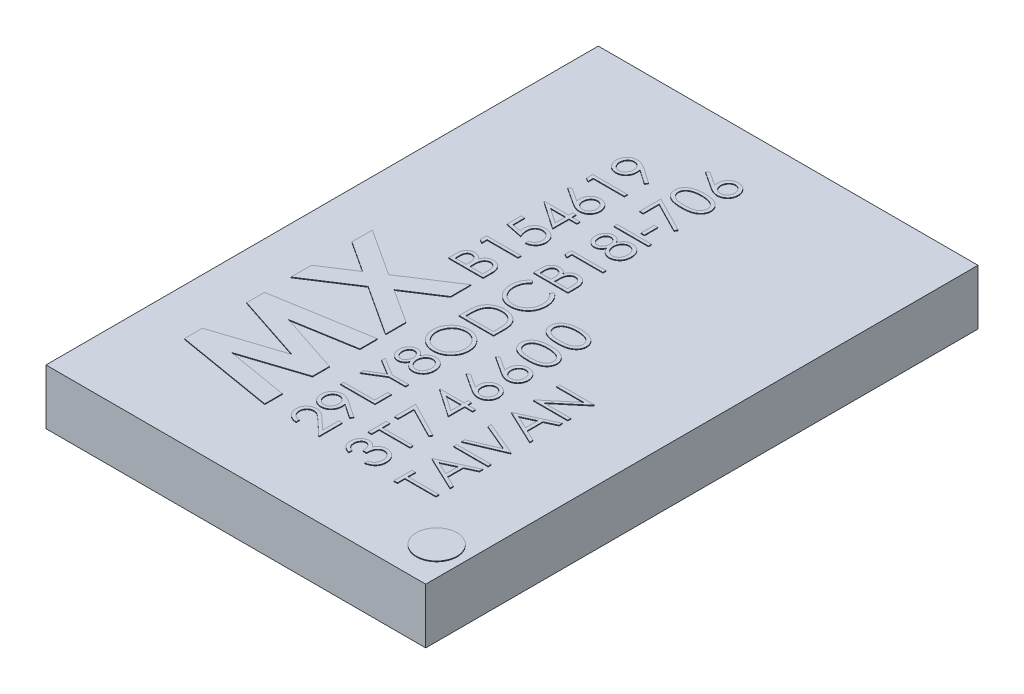
from build123d import *

# Parameters (mm, degrees)
ESQUISSE1_W        = 5.5
ESQUISSE1_H        = 8
BOSS_EXTRU_1_DEPTH = 0.8
ESQUISSE2_R        = 0.294488104
ESQUISSE2_W        = 0.5
ESQUISSE2_H        = 0.044871795
ESQUISSE2_W_2      = 0.051282051
ESQUISSE2_H_2      = 0.192307693
BOSS_EXTRU_2_DEPTH = 0.01


with BuildPart() as part:
    # Esquisse1 → Boss.-Extru.1 (new body)
    with BuildSketch(Plane(origin=(0, 0, 0), x_dir=(1, 0, 0), z_dir=(0, 1, 0))):
        Rectangle(ESQUISSE1_W, ESQUISSE1_H)
    extrude(amount=BOSS_EXTRU_1_DEPTH)

    # Esquisse2 → Boss.-Extru.2 (add)
    # profile 1 of 40: a face of its own
    with BuildSketch(Plane(origin=(0, 0.8, 0), x_dir=(1, 0, 0), z_dir=(0, 1, 0))):
        with Locations(Location((2.340891929, -3.432066144, 0), (0, 0, 270))):
            Circle(ESQUISSE2_R)
    # profile 2 of 40: a face of its own
    with BuildSketch(Plane(origin=(0, 0.8, 0), x_dir=(1, 0, 0), z_dir=(0, 1, 0))):
        Polygon((-2.068081286, -2.677429191), (-2.068081286, -2.416611884), (-1.09155885, -2.097180794), (-2.068081286, -1.775506114), (-2.068081286, -1.517212845), (-0.668081286, -1.280514127), (-0.668081286, -1.534881114), (-1.552336093, -1.684360281), (-0.668081286, -1.97546605), (-0.668081286, -2.22057823), (-1.552336093, -2.510001307), (-0.668081286, -2.659200025), (-0.668081286, -2.91384746), align=None)
    # profile 3 of 40: a face of its own
    with BuildSketch(Plane(origin=(0, 0.8, 0), x_dir=(1, 0, 0), z_dir=(0, 1, 0))):
        Polygon((-2.068081286, -1.132717653), (-2.068081286, -0.836563807), (-1.618521991, -0.544055794), (-2.068081286, -0.250986884), (-2.068081286, 0.045447411), (-1.39107808, -0.395978871), (-0.668081286, 0.074614078), (-0.668081286, -0.221539768), (-1.163914619, -0.544055794), (-0.668081286, -0.867413166), (-0.668081286, -1.16384746), (-1.391358529, -0.692132717), align=None)
    # profile 4 of 40: a face of its own
    with BuildSketch(Plane(origin=(0, 0.8, 0), x_dir=(1, 0, 0), z_dir=(0, 1, 0))):
        with BuildLine():
            Line((-1.168081286, 0.25), (-1.168081286, 0.34755609))
            add(Edge.make_bspline(
                [(-1.168081286, 0.34755609), (-1.168056574, 0.352331662), (-1.168008676, 0.361587909), (-1.167248571, 0.375046806), (-1.166238084, 0.387657325), (-1.164543045, 0.399397181), (-1.162785515, 0.410342764), (-1.16020588, 0.420382953), (-1.157356579, 0.429601848), (-1.152972544, 0.440671853), (-1.146164081, 0.453232291), (-1.136066485, 0.466732412), (-1.123960281, 0.478467541), (-1.110164308, 0.488445879), (-1.094987174, 0.496453707), (-1.07875542, 0.502173727), (-1.061742126, 0.505848485), (-1.05007794, 0.50622166), (-1.044183048, 0.506410256)],
                knots=[0, 0, 0, 0, 1.00128172, 1.940733171, 2.826250472, 3.653024905, 4.427672124, 5.149348099, 5.824709082, 6.450061444, 7.643590664, 8.808605388, 9.972104426, 11.165284501, 12.367876273, 13.557044126, 14.765369432, 16, 16, 16, 16], degree=3))
            add(Edge.make_bspline(
                [(-1.044183048, 0.506410256), (-1.038661497, 0.506253169), (-1.027811129, 0.505944478), (-1.011968581, 0.503028625), (-0.996903243, 0.49840075), (-0.98262801, 0.492004839), (-0.969408616, 0.483764067), (-0.957286012, 0.473890463), (-0.946718365, 0.462027407), (-0.940812678, 0.45313482), (-0.937812856, 0.448617788)],
                knots=[0, 0, 0, 0, 1.044641374, 2.052818814, 3.038628718, 4.023282556, 5.005660861, 5.98021751, 6.974042014, 8, 8, 8, 8], degree=3))
            add(Edge.make_bspline(
                [(-0.937812856, 0.448617788), (-0.935631436, 0.454297301), (-0.931457838, 0.465163616), (-0.924090505, 0.480125876), (-0.916048356, 0.492969803), (-0.907401609, 0.503946295), (-0.897943876, 0.513284449), (-0.887598318, 0.521371831), (-0.876373403, 0.528363529), (-0.864310387, 0.534313417), (-0.851511533, 0.538987127), (-0.838133168, 0.54242224), (-0.824226576, 0.544454183), (-0.814789284, 0.544731372), (-0.810008369, 0.544871795)],
                knots=[0, 0, 0, 0, 1.272586185, 2.434772614, 3.483318042, 4.437947805, 5.351807173, 6.25737843, 7.180033415, 8.1141739, 9.066731021, 10.025721652, 10.999834114, 12, 12, 12, 12], degree=3))
            add(Edge.make_bspline(
                [(-0.810008369, 0.544871795), (-0.805127367, 0.544732276), (-0.79552386, 0.544457769), (-0.781416267, 0.542431623), (-0.767933089, 0.539003351), (-0.754993328, 0.534273011), (-0.742624113, 0.528141702), (-0.730870255, 0.520572258), (-0.719707299, 0.511670939), (-0.709115544, 0.50161101), (-0.699423756, 0.490400005), (-0.691092086, 0.478044757), (-0.683928037, 0.464883738), (-0.678095324, 0.450748698), (-0.67359539, 0.43567572), (-0.670460174, 0.419673192), (-0.668344125, 0.402767467), (-0.668170385, 0.391165989), (-0.668081286, 0.385216346)],
                knots=[0, 0, 0, 0, 0.978680899, 1.925582087, 2.851223405, 3.764209995, 4.683484765, 5.614004905, 6.562443559, 7.542772147, 8.539900013, 9.527881485, 10.525548727, 11.540192123, 12.58875426, 13.674701727, 14.807505862, 16, 16, 16, 16], degree=3))
            Line((-0.668081286, 0.385216346), (-0.668081286, 0.25))
            Line((-0.668081286, 0.25), (-1.168081286, 0.25))
        make_face()
        with BuildLine():
            Line((-1.116799234, 0.294871795), (-0.956542824, 0.294871795))
            Line((-0.956542824, 0.294871795), (-0.956542824, 0.325020032))
            add(Edge.make_bspline(
                [(-0.956542824, 0.325020032), (-0.956599956, 0.329427003), (-0.956710346, 0.337942168), (-0.957026563, 0.350273582), (-0.957911997, 0.361720014), (-0.958797179, 0.372261703), (-0.960236402, 0.381882057), (-0.961949575, 0.390559736), (-0.963761376, 0.398431014), (-0.966842914, 0.407507879), (-0.971395628, 0.417805457), (-0.978467929, 0.428775918), (-0.986884859, 0.438492178), (-0.996687676, 0.446598621), (-1.007364668, 0.4532917), (-1.0188221, 0.457980413), (-1.030829406, 0.461106238), (-1.039088354, 0.461392911), (-1.043281606, 0.461538462)],
                knots=[0, 0, 0, 0, 1.156917035, 2.235399477, 3.236897345, 4.169954739, 5.01148057, 5.788325709, 6.491867502, 7.129259015, 8.302032419, 9.437271567, 10.542795419, 11.662606952, 12.764338259, 13.836858145, 14.901724648, 16, 16, 16, 16], degree=3))
            add(Edge.make_bspline(
                [(-1.043281606, 0.461538462), (-1.04605708, 0.46146456), (-1.051501475, 0.461319594), (-1.059463932, 0.460089191), (-1.06694572, 0.458095611), (-1.074018646, 0.455395766), (-1.080506932, 0.451707377), (-1.086720604, 0.44743205), (-1.092287494, 0.442153552), (-1.097475614, 0.436188381), (-1.102118963, 0.429363161), (-1.105965259, 0.421530842), (-1.10945128, 0.412893903), (-1.112031878, 0.403218019), (-1.11430111, 0.392703676), (-1.115726883, 0.381208507), (-1.116644382, 0.368805355), (-1.116746466, 0.360211528), (-1.116799234, 0.355769231)],
                knots=[0, 0, 0, 0, 0.911708768, 1.788416306, 2.640049961, 3.452993646, 4.268229297, 5.087074648, 5.92553149, 6.781184137, 7.681934069, 8.628939405, 9.643570426, 10.73771997, 11.914765019, 13.176320755, 14.540391495, 16, 16, 16, 16], degree=3))
            Line((-1.116799234, 0.355769231), (-1.116799234, 0.294871795))
        make_face(mode=Mode.SUBTRACT)
        with BuildLine():
            Line((-0.905260773, 0.294871795), (-0.719363337, 0.294871795))
            Line((-0.719363337, 0.294871795), (-0.719363337, 0.358774038))
            add(Edge.make_bspline(
                [(-0.719363337, 0.358774038), (-0.719423609, 0.363347692), (-0.719539775, 0.372162807), (-0.71981221, 0.384900342), (-0.720842789, 0.39667526), (-0.721793494, 0.407524707), (-0.723419158, 0.417419888), (-0.724953362, 0.426436919), (-0.727230779, 0.434427778), (-0.73036082, 0.443778932), (-0.735371627, 0.454231361), (-0.74269237, 0.465653984), (-0.751727296, 0.475614334), (-0.762002813, 0.484164365), (-0.773144609, 0.491220222), (-0.785007027, 0.496283467), (-0.797359365, 0.499429948), (-0.805783546, 0.4998096), (-0.810008369, 0.5)],
                knots=[0, 0, 0, 0, 1.160376723, 2.23647316, 3.230273494, 4.158083346, 4.997711197, 5.773399541, 6.476071462, 7.102777513, 8.27340052, 9.405620712, 10.53304798, 11.669441455, 12.787990954, 13.865552736, 14.929550474, 16, 16, 16, 16], degree=3))
            add(Edge.make_bspline(
                [(-0.810008369, 0.5), (-0.812650332, 0.499960677), (-0.817891642, 0.499882666), (-0.825593072, 0.498700817), (-0.833056976, 0.496991057), (-0.840314457, 0.494739252), (-0.847243489, 0.491591352), (-0.853870647, 0.487732289), (-0.860329431, 0.483314906), (-0.868600463, 0.47649972), (-0.87801175, 0.466442244), (-0.887112165, 0.452149448), (-0.894569867, 0.435987764), (-0.897722664, 0.424238458), (-0.899351318, 0.418169071)],
                knots=[0, 0, 0, 0, 0.723302347, 1.434937762, 2.129609326, 2.821140842, 3.513216847, 4.209993937, 4.920569932, 5.655069131, 7.14393391, 8.6716197, 10.280644748, 12, 12, 12, 12], degree=3))
            add(Edge.make_bspline(
                [(-0.899351318, 0.418169071), (-0.899844901, 0.415736343), (-0.900915092, 0.410461686), (-0.902044764, 0.401860604), (-0.903051201, 0.392041194), (-0.903795652, 0.380980783), (-0.904565158, 0.368665377), (-0.904864418, 0.355068674), (-0.905221455, 0.340246201), (-0.905247332, 0.329961576), (-0.905260773, 0.324619391)],
                knots=[0, 0, 0, 0, 0.634451884, 1.375622551, 2.216452059, 3.157844607, 4.20941857, 5.370758133, 6.634282058, 8, 8, 8, 8], degree=3))
            Line((-0.905260773, 0.324619391), (-0.905260773, 0.294871795))
        make_face(mode=Mode.SUBTRACT)
    # profile 5 of 40: a face of its own
    with BuildSketch(Plane(origin=(0, 0.8, 0), x_dir=(1, 0, 0), z_dir=(0, 1, 0))):
        Polygon((-1.168081286, 0.708834135), (-1.168081286, 0.801282051), (-0.668081286, 0.801282051), (-0.668081286, 0.756410256), (-1.116799234, 0.756410256), (-1.116799234, 0.679487179), align=None)
    # profile 6 of 40: a face of its own
    with BuildSketch(Plane(origin=(0, 0.8, 0), x_dir=(1, 0, 0), z_dir=(0, 1, 0))):
        with BuildLine():
            Line((-1.168081286, 1.301282051), (-1.116799234, 1.301282051))
            Line((-1.116799234, 1.301282051), (-1.116799234, 1.131209936))
            Line((-1.116799234, 1.131209936), (-0.985288818, 1.104266827))
            add(Edge.make_bspline(
                [(-0.985288818, 1.104266827), (-0.986750285, 1.109560523), (-0.989581647, 1.119816223), (-0.992725328, 1.134953346), (-0.994620392, 1.14932366), (-0.99487915, 1.158648713), (-0.995004362, 1.163161058)],
                knots=[0, 0, 0, 0, 1.100273476, 2.13160584, 3.095893838, 4, 4, 4, 4], degree=3))
            add(Edge.make_bspline(
                [(-0.995004362, 1.163161058), (-0.994887505, 1.168745474), (-0.994657736, 1.179725832), (-0.992320426, 1.195766447), (-0.988935025, 1.211156066), (-0.983719172, 1.225667464), (-0.977349686, 1.239530224), (-0.969327179, 1.252506271), (-0.959960923, 1.264777725), (-0.949299154, 1.27625977), (-0.937443351, 1.286627341), (-0.924643276, 1.295636419), (-0.911178248, 1.303499673), (-0.896732675, 1.309632305), (-0.881579004, 1.314637131), (-0.865542312, 1.317937326), (-0.848764967, 1.320141713), (-0.837292753, 1.32038749), (-0.831442664, 1.320512821)],
                knots=[0, 0, 0, 0, 1.052805225, 2.070078116, 3.052532748, 4.020689046, 4.973125432, 5.925915817, 6.89216474, 7.881560752, 8.877013184, 9.857446635, 10.830895175, 11.812622661, 12.812548702, 13.836681939, 14.896847428, 16, 16, 16, 16], degree=3))
            add(Edge.make_bspline(
                [(-0.831442664, 1.320512821), (-0.827368086, 1.320417724), (-0.819273996, 1.320228817), (-0.807253022, 1.319270273), (-0.795488292, 1.317417646), (-0.784001373, 1.314960486), (-0.772781507, 1.311680299), (-0.761765876, 1.307843525), (-0.751075098, 1.303074668), (-0.740661957, 1.297787857), (-0.730645629, 1.291933711), (-0.721266272, 1.285350854), (-0.712309848, 1.278510885), (-0.704042349, 1.271036957), (-0.696431707, 1.263014044), (-0.689440296, 1.254486786), (-0.682942642, 1.245532526), (-0.677204415, 1.236010236), (-0.671923969, 1.226132769), (-0.667592042, 1.215757301), (-0.663719108, 1.20512006), (-0.660632033, 1.194067934), (-0.658213096, 1.182625961), (-0.656570153, 1.170775279), (-0.655373519, 1.158578041), (-0.655298611, 1.150310182), (-0.655260773, 1.146133814)],
                knots=[0, 0, 0, 0, 1.056393913, 2.098511576, 3.122979385, 4.141471433, 5.141222888, 6.151259816, 7.162667642, 8.172852865, 9.177685681, 10.166741883, 11.141342384, 12.097242845, 13.052202613, 14.005160326, 14.953864445, 15.917140761, 16.884916217, 17.854238259, 18.828761908, 19.81781811, 20.826036654, 21.857789401, 22.917898972, 24, 24, 24, 24], degree=3))
            add(Edge.make_bspline(
                [(-0.655260773, 1.146133814), (-0.655359729, 1.141151915), (-0.655554415, 1.131350618), (-0.657581843, 1.116988726), (-0.660504791, 1.103178967), (-0.664835295, 1.089980527), (-0.670505783, 1.077448452), (-0.67724318, 1.065403284), (-0.685263948, 1.053994319), (-0.694494724, 1.043299556), (-0.704637402, 1.033468698), (-0.715538794, 1.024554003), (-0.727212784, 1.016716341), (-0.73962141, 1.00992728), (-0.752742664, 1.004143618), (-0.766616974, 0.999598132), (-0.781174228, 0.995929929), (-0.791196143, 0.994377993), (-0.796286414, 0.993589744)],
                knots=[0, 0, 0, 0, 1.046872515, 2.059598001, 3.044168548, 4.012104806, 4.973680974, 5.932408326, 6.910122221, 7.900780896, 8.89867654, 9.876692837, 10.858029398, 11.85084981, 12.847361615, 13.868568023, 14.917415949, 16, 16, 16, 16], degree=3))
            Line((-0.796286414, 0.993589744), (-0.796286414, 1.038461538))
            add(Edge.make_bspline(
                [(-0.796286414, 1.038461538), (-0.791517853, 1.039564927), (-0.782352413, 1.041685702), (-0.769483114, 1.046352858), (-0.758010945, 1.052003853), (-0.747865765, 1.05888013), (-0.738861868, 1.066850615), (-0.730923153, 1.076115892), (-0.723752325, 1.086444332), (-0.717764824, 1.097927529), (-0.712721162, 1.110065824), (-0.70912184, 1.122697695), (-0.706943092, 1.135641345), (-0.706676749, 1.144356005), (-0.706542824, 1.148737981)],
                knots=[0, 0, 0, 0, 1.13623081, 2.183898708, 3.172478118, 4.09966615, 5.022692284, 5.957376522, 6.927682873, 7.937366477, 8.960015386, 9.976409503, 10.982481913, 12, 12, 12, 12], degree=3))
            add(Edge.make_bspline(
                [(-0.706542824, 1.148737981), (-0.706661059, 1.153017395), (-0.706893865, 1.161443598), (-0.708656795, 1.173850432), (-0.711443227, 1.185793754), (-0.71534686, 1.197294765), (-0.720511137, 1.208296951), (-0.726855153, 1.218784756), (-0.734220632, 1.228907589), (-0.742639105, 1.23839903), (-0.751921537, 1.247089922), (-0.761846605, 1.254769488), (-0.772434798, 1.261166158), (-0.783502372, 1.266556754), (-0.795170743, 1.27065008), (-0.807385195, 1.273570221), (-0.820175907, 1.275284943), (-0.828900094, 1.275520826), (-0.833345709, 1.275641026)],
                knots=[0, 0, 0, 0, 1.027268864, 2.022700798, 3.002744649, 3.968653148, 4.933396556, 5.915045722, 6.907600446, 7.935526002, 8.956456544, 9.95700807, 10.942805781, 11.92166854, 12.907987664, 13.905483474, 14.932689774, 16, 16, 16, 16], degree=3))
            add(Edge.make_bspline(
                [(-0.833345709, 1.275641026), (-0.837357004, 1.275549815), (-0.845175435, 1.275372037), (-0.856654099, 1.273833022), (-0.867532497, 1.271262122), (-0.877857961, 1.267601682), (-0.887597479, 1.263033337), (-0.896729587, 1.257297641), (-0.905340152, 1.250638824), (-0.913207587, 1.242864807), (-0.920480298, 1.234408286), (-0.926657611, 1.225052054), (-0.931910914, 1.215045888), (-0.936215066, 1.204371244), (-0.939643653, 1.193014975), (-0.942013197, 1.180970963), (-0.943431096, 1.168236464), (-0.943623441, 1.159525657), (-0.943722311, 1.155048077)],
                knots=[0, 0, 0, 0, 1.045723156, 2.038222538, 3.013889863, 3.95567481, 4.890389958, 5.81331128, 6.76251276, 7.723027653, 8.692928204, 9.666105983, 10.639751036, 11.635719707, 12.66315958, 13.728667616, 14.832476222, 16, 16, 16, 16], degree=3))
            add(Edge.make_bspline(
                [(-0.943722311, 1.155048077), (-0.94363937, 1.151172516), (-0.943468116, 1.143170465), (-0.942207188, 1.130895775), (-0.940173003, 1.117996958), (-0.937374968, 1.104523458), (-0.933713385, 1.090434814), (-0.9293256, 1.075760757), (-0.9240796, 1.060470433), (-0.920117855, 1.050167901), (-0.918081286, 1.044871795)],
                knots=[0, 0, 0, 0, 0.817624296, 1.688186739, 2.600797293, 3.572016777, 4.590301741, 5.671205678, 6.80286297, 8, 8, 8, 8], degree=3))
            Line((-0.918081286, 1.044871795), (-1.168081286, 1.096153846))
            Line((-1.168081286, 1.096153846), (-1.168081286, 1.301282051))
        make_face()
    # profile 7 of 40: a face of its own
    with BuildSketch(Plane(origin=(0, 0.8, 0), x_dir=(1, 0, 0), z_dir=(0, 1, 0))):
        Polygon((-1.180901798, 1.644731571), (-1.180901798, 1.653846154), (-0.834747952, 1.653846154), (-0.834747952, 1.711538462), (-0.783465901, 1.711538462), (-0.783465901, 1.653846154), (-0.668081286, 1.653846154), (-0.668081286, 1.608974359), (-0.783465901, 1.608974359), (-0.783465901, 1.371794872), align=None)
        Polygon((-0.834747952, 1.608974359), (-1.051895388, 1.608974359), (-0.834747952, 1.459935897), align=None, mode=Mode.SUBTRACT)
    # profile 8 of 40: a face of its own
    with BuildSketch(Plane(origin=(0, 0.8, 0), x_dir=(1, 0, 0), z_dir=(0, 1, 0))):
        with BuildLine():
            Line((-1.180901798, 1.987179487), (-1.153758369, 2.021734776))
            Line((-1.153758369, 2.021734776), (-0.951735132, 1.889623397))
            add(Edge.make_bspline(
                [(-0.951735132, 1.889623397), (-0.953137112, 1.898419151), (-0.955871832, 1.915576264), (-0.956322968, 1.932942821), (-0.956542824, 1.94140625)],
                knots=[0, 0, 0, 0, 1.025318673, 2, 2, 2, 2], degree=3))
            add(Edge.make_bspline(
                [(-0.956542824, 1.94140625), (-0.956406237, 1.946488035), (-0.956137368, 1.956491378), (-0.954068247, 1.971178064), (-0.950807517, 1.98529077), (-0.946054336, 1.998770998), (-0.939982575, 2.011667146), (-0.932705581, 2.024053174), (-0.923847675, 2.035696427), (-0.913952496, 2.046746178), (-0.902993615, 2.056780172), (-0.891362364, 2.065656856), (-0.879059664, 2.073153958), (-0.86608828, 2.079126941), (-0.852549752, 2.083900412), (-0.838391278, 2.087298542), (-0.823588961, 2.089329996), (-0.81352035, 2.089604268), (-0.808405805, 2.08974359)],
                knots=[0, 0, 0, 0, 1.043709831, 2.054511743, 3.041122595, 4.01515914, 4.98481438, 5.965901842, 6.960491961, 7.985277438, 9.0096037, 10.00832444, 10.987059228, 11.962929573, 12.936966118, 13.931840027, 14.949438142, 16, 16, 16, 16], degree=3))
            add(Edge.make_bspline(
                [(-0.808405805, 2.08974359), (-0.801408442, 2.089540783), (-0.787639289, 2.089141708), (-0.767589215, 2.085148393), (-0.748499309, 2.078989491), (-0.730699896, 2.070045425), (-0.714067697, 2.059146453), (-0.699379027, 2.045692015), (-0.686279074, 2.030349645), (-0.675329307, 2.012992523), (-0.666385694, 1.994315463), (-0.659962173, 1.974693614), (-0.656007369, 1.954318343), (-0.655511572, 1.940489108), (-0.655260773, 1.93349359)],
                knots=[0, 0, 0, 0, 1.031403119, 2.029557249, 3.004870281, 3.983165322, 4.960181699, 5.929903783, 6.912123683, 7.928973898, 8.949315281, 9.960468141, 10.968302741, 12, 12, 12, 12], degree=3))
            add(Edge.make_bspline(
                [(-0.655260773, 1.93349359), (-0.655478467, 1.926765206), (-0.655909683, 1.913437457), (-0.659771033, 1.893836914), (-0.665985109, 1.87496983), (-0.674725621, 1.85707839), (-0.685579508, 1.840477165), (-0.698555072, 1.825506198), (-0.71367034, 1.812566722), (-0.730594657, 1.801701458), (-0.748755652, 1.793047277), (-0.767725051, 1.786618019), (-0.787423216, 1.782842733), (-0.800777911, 1.782316389), (-0.807504362, 1.782051282)],
                knots=[0, 0, 0, 0, 1.012172929, 2.004937354, 2.995255351, 3.995689452, 4.993936421, 5.973737378, 6.968231049, 7.979117505, 8.993136101, 9.989812463, 10.987515067, 12, 12, 12, 12], degree=3))
            add(Edge.make_bspline(
                [(-0.807504362, 1.782051282), (-0.812653589, 1.78222006), (-0.823167325, 1.782564672), (-0.839090757, 1.784970871), (-0.855383769, 1.78883727), (-0.869205797, 1.793167305), (-0.880528871, 1.797742392), (-0.889657941, 1.801549898), (-0.89905238, 1.80628904), (-0.909034328, 1.81134238), (-0.919346533, 1.81716479), (-0.930161343, 1.823495597), (-0.941306761, 1.830509833), (-0.948870217, 1.835426999), (-0.952736734, 1.837940705)],
                knots=[0, 0, 0, 0, 1.173818275, 2.396712641, 3.66331629, 4.989737886, 5.693666774, 6.447286557, 7.243889047, 8.091586357, 8.998013824, 9.943181721, 10.948533338, 12, 12, 12, 12], degree=3))
            Line((-0.952736734, 1.837940705), (-1.180901798, 1.987179487))
        make_face()
        with BuildLine():
            add(Edge.make_bspline(
                [(-0.905260773, 1.931991186), (-0.905150697, 1.928181923), (-0.904935686, 1.920741325), (-0.903659926, 1.909831171), (-0.901337898, 1.89947192), (-0.898118203, 1.889660566), (-0.894148696, 1.880336583), (-0.889055471, 1.871684747), (-0.883123025, 1.863527022), (-0.876362092, 1.855993748), (-0.86896477, 1.849161965), (-0.861040301, 1.843279051), (-0.852781194, 1.838204395), (-0.844118042, 1.834078428), (-0.835054261, 1.830865558), (-0.82563151, 1.828541523), (-0.81578661, 1.82724813), (-0.809110538, 1.827032954), (-0.805701478, 1.826923077)],
                knots=[0, 0, 0, 0, 1.129656352, 2.206547016, 3.251334079, 4.271920891, 5.265058649, 6.249872215, 7.241923875, 8.251504132, 9.246416584, 10.222533834, 11.173322129, 12.116503788, 13.062124155, 14.020151864, 14.989013135, 16, 16, 16, 16], degree=3))
            add(Edge.make_bspline(
                [(-0.805701478, 1.826923077), (-0.8023235, 1.827015726), (-0.795666779, 1.827198302), (-0.785895393, 1.828752753), (-0.776513655, 1.831237381), (-0.767556823, 1.834826593), (-0.75885295, 1.839188202), (-0.750673739, 1.844786661), (-0.742754248, 1.851212067), (-0.735462442, 1.858714315), (-0.728693026, 1.866827214), (-0.7227516, 1.875476716), (-0.717727508, 1.884532586), (-0.713564493, 1.893968745), (-0.71049992, 1.903901834), (-0.708153823, 1.914170565), (-0.706871179, 1.924914554), (-0.706653712, 1.932188425), (-0.706542824, 1.935897436)],
                knots=[0, 0, 0, 0, 0.989367052, 1.949669134, 2.891858276, 3.827522767, 4.772653562, 5.738670152, 6.725809442, 7.756636004, 8.798867547, 9.819240912, 10.826537776, 11.829883227, 12.835515726, 13.868058748, 14.912904531, 16, 16, 16, 16], degree=3))
            add(Edge.make_bspline(
                [(-0.706542824, 1.935897436), (-0.706653721, 1.93960644), (-0.706871205, 1.9468803), (-0.708153725, 1.957624375), (-0.710500276, 1.967892787), (-0.713563202, 1.977827036), (-0.717732324, 1.987258892), (-0.722720159, 1.996306847), (-0.728729456, 2.004874543), (-0.735450819, 2.012992722), (-0.742795914, 2.020463792), (-0.750602381, 2.027040316), (-0.758918397, 2.032463868), (-0.7675226, 2.03699841), (-0.776519005, 2.040547881), (-0.785893933, 2.043044742), (-0.79566716, 2.044595886), (-0.802323628, 2.044778916), (-0.805701478, 2.044871795)],
                knots=[0, 0, 0, 0, 1.087281468, 2.132306021, 3.165025708, 4.170830268, 5.174347389, 6.181816599, 7.194310624, 8.23672049, 9.267723423, 10.261267456, 11.222032883, 12.171822355, 13.107646935, 14.049997283, 15.01046367, 16, 16, 16, 16], degree=3))
            add(Edge.make_bspline(
                [(-0.805701478, 2.044871795), (-0.809114985, 2.044793182), (-0.81581459, 2.044638889), (-0.825627106, 2.042893754), (-0.835102137, 2.040473415), (-0.844180125, 2.036818695), (-0.852825275, 2.032070623), (-0.861081152, 2.026287254), (-0.86901146, 2.019596988), (-0.876376567, 2.011868371), (-0.883115695, 2.00345699), (-0.889047312, 1.994506375), (-0.894110564, 1.985179735), (-0.898105871, 1.97534569), (-0.901324535, 1.965136557), (-0.903651647, 1.95448184), (-0.904932361, 1.943373961), (-0.905149908, 1.935833772), (-0.905260773, 1.931991186)],
                knots=[0, 0, 0, 0, 0.978259475, 1.920005202, 2.851759169, 3.7803069, 4.719124913, 5.675758531, 6.668034766, 7.691045932, 8.733780038, 9.756656648, 10.768121246, 11.773215211, 12.79725739, 13.836288844, 14.897342417, 16, 16, 16, 16], degree=3))
        make_face(mode=Mode.SUBTRACT)
    # profile 9 of 40: a face of its own
    with BuildSketch(Plane(origin=(0, 0.8, 0), x_dir=(1, 0, 0), z_dir=(0, 1, 0))):
        Polygon((-1.168081286, 2.247295673), (-1.168081286, 2.33974359), (-0.668081286, 2.33974359), (-0.668081286, 2.294871795), (-1.116799234, 2.294871795), (-1.116799234, 2.217948718), align=None)
    # profile 10 of 40: a face of its own
    with BuildSketch(Plane(origin=(0, 0.8, 0), x_dir=(1, 0, 0), z_dir=(0, 1, 0))):
        with BuildLine():
            Line((-0.655260773, 2.634615385), (-0.680200677, 2.598758013))
            Line((-0.680200677, 2.598758013), (-0.883425837, 2.737780449))
            add(Edge.make_bspline(
                [(-0.883425837, 2.737780449), (-0.882290498, 2.72891157), (-0.880055547, 2.71145289), (-0.879763457, 2.693854737), (-0.879619747, 2.685196314)],
                knots=[0, 0, 0, 0, 1.015985029, 2, 2, 2, 2], degree=3))
            add(Edge.make_bspline(
                [(-0.879619747, 2.685196314), (-0.879754187, 2.67994745), (-0.88001808, 2.669644389), (-0.882109766, 2.65449701), (-0.885331213, 2.639941931), (-0.890138177, 2.626017735), (-0.896112211, 2.612672099), (-0.903520342, 2.59993411), (-0.91223558, 2.587821098), (-0.922211518, 2.576462459), (-0.933166279, 2.56613383), (-0.944757227, 2.556924664), (-0.957109486, 2.549312815), (-0.969962545, 2.542876763), (-0.983590738, 2.538132637), (-0.99776282, 2.53459446), (-1.012566763, 2.532440012), (-1.022641468, 2.532182188), (-1.027756766, 2.532051282)],
                knots=[0, 0, 0, 0, 1.060698949, 2.082059282, 3.085738422, 4.069684654, 5.054463875, 6.037298355, 7.043153692, 8.066652628, 9.088369706, 10.083456696, 11.053578809, 12.016466116, 12.983507685, 13.964045196, 14.966270913, 16, 16, 16, 16], degree=3))
            add(Edge.make_bspline(
                [(-1.027756766, 2.532051282), (-1.034752018, 2.532299556), (-1.048482279, 2.532786869), (-1.068548084, 2.536693856), (-1.087531663, 2.543167012), (-1.105411786, 2.552051082), (-1.121777747, 2.563455398), (-1.136574099, 2.576998868), (-1.149536894, 2.592790954), (-1.16066698, 2.610419352), (-1.169679444, 2.62944462), (-1.176082415, 2.649452635), (-1.180172783, 2.670106349), (-1.180657745, 2.684142405), (-1.180901798, 2.691205929)],
                knots=[0, 0, 0, 0, 1.023011052, 2.007963168, 2.978169221, 3.950402619, 4.919353283, 5.887490769, 6.876420893, 7.899700203, 8.931203047, 9.947778163, 10.96723692, 12, 12, 12, 12], degree=3))
            add(Edge.make_bspline(
                [(-1.180901798, 2.691205929), (-1.180640345, 2.698132844), (-1.180123738, 2.711819775), (-1.176340334, 2.731946809), (-1.169963589, 2.751223972), (-1.161151801, 2.769545155), (-1.150104872, 2.786506183), (-1.13694677, 2.801766257), (-1.121666509, 2.814920432), (-1.104683834, 2.826135392), (-1.086324489, 2.834970189), (-1.067197101, 2.841443852), (-1.047416723, 2.845400971), (-1.034017973, 2.845901328), (-1.027255965, 2.846153846)],
                knots=[0, 0, 0, 0, 1.026358223, 2.027987109, 3.023239252, 4.028077889, 5.032770297, 6.015020143, 7.004250571, 8.011656937, 9.02310243, 10.015224881, 10.998334443, 12, 12, 12, 12], degree=3))
            add(Edge.make_bspline(
                [(-1.027255965, 2.846153846), (-1.022007048, 2.845984752), (-1.011360934, 2.845641788), (-0.995214294, 2.843267468), (-0.978764155, 2.839171923), (-0.964827137, 2.834595719), (-0.953281068, 2.830110268), (-0.94413374, 2.826009904), (-0.934572664, 2.821246766), (-0.924558688, 2.81592721), (-0.914078746, 2.810061316), (-0.903205526, 2.803489621), (-0.891923175, 2.796300764), (-0.884316276, 2.791182564), (-0.880421029, 2.788561699)],
                knots=[0, 0, 0, 0, 1.179894106, 2.393120058, 3.660107319, 4.986885617, 5.687958251, 6.443931318, 7.239444731, 8.088894906, 8.992865148, 9.938946712, 10.944601238, 12, 12, 12, 12], degree=3))
            Line((-0.880421029, 2.788561699), (-0.655260773, 2.634615385))
        make_face()
        with BuildLine():
            add(Edge.make_bspline(
                [(-0.930901798, 2.693509615), (-0.93101065, 2.697485808), (-0.931222546, 2.705226102), (-0.932506459, 2.716567041), (-0.934799695, 2.72726573), (-0.938038064, 2.737391029), (-0.942140431, 2.746930679), (-0.947139837, 2.755887685), (-0.953145808, 2.764170555), (-0.95989664, 2.771808778), (-0.967295283, 2.778740698), (-0.975222242, 2.78471761), (-0.983431254, 2.789892534), (-0.992090369, 2.794020967), (-1.001057934, 2.797348061), (-1.010463637, 2.799669591), (-1.020242538, 2.800951804), (-1.026885126, 2.801170774), (-1.030260773, 2.801282051)],
                knots=[0, 0, 0, 0, 1.163726718, 2.265380301, 3.334713825, 4.36057981, 5.371541381, 6.368955992, 7.355979581, 8.359691305, 9.348261197, 10.317521986, 11.261029684, 12.183096459, 13.119698615, 14.055740009, 15.011961376, 16, 16, 16, 16], degree=3))
            add(Edge.make_bspline(
                [(-1.030260773, 2.801282051), (-1.033637914, 2.801186477), (-1.040292985, 2.800998136), (-1.050085141, 2.799484332), (-1.059472365, 2.796828546), (-1.068518564, 2.793229059), (-1.077174283, 2.788577268), (-1.085466805, 2.782940984), (-1.093270609, 2.776135051), (-1.100714307, 2.768529725), (-1.107467001, 2.760164775), (-1.113433176, 2.75130206), (-1.118468302, 2.741988924), (-1.12244433, 2.732183821), (-1.125701632, 2.722019903), (-1.128007506, 2.711391948), (-1.129292157, 2.700285269), (-1.129509159, 2.692744914), (-1.129619747, 2.688902244)],
                knots=[0, 0, 0, 0, 0.971910406, 1.91526867, 2.84337505, 3.775008003, 4.712374136, 5.666733183, 6.654995996, 7.688089235, 8.726800303, 9.745078658, 10.75990398, 11.768337501, 12.786615857, 13.829099629, 14.893678693, 16, 16, 16, 16], degree=3))
            add(Edge.make_bspline(
                [(-1.129619747, 2.688902244), (-1.129508978, 2.685092993), (-1.129291649, 2.677619274), (-1.128009974, 2.666611328), (-1.125685968, 2.656055252), (-1.122445806, 2.645920837), (-1.118467997, 2.636116019), (-1.11343291, 2.626803322), (-1.107468386, 2.617938542), (-1.100708931, 2.60958155), (-1.09330532, 2.601962516), (-1.085431935, 2.59527175), (-1.077178673, 2.589622719), (-1.068517404, 2.584977426), (-1.059472673, 2.581376221), (-1.050085057, 2.578720894), (-1.040293007, 2.577206967), (-1.033637921, 2.577018643), (-1.030260773, 2.576923077)],
                knots=[0, 0, 0, 0, 1.099107991, 2.156440826, 3.191784126, 4.212280276, 5.222910149, 6.239945746, 7.260441896, 8.30141526, 9.33675856, 10.320924759, 11.277362386, 12.216770088, 13.150432123, 14.080559904, 15.025972789, 16, 16, 16, 16], degree=3))
            add(Edge.make_bspline(
                [(-1.030260773, 2.576923077), (-1.026882508, 2.577009732), (-1.020219951, 2.577180631), (-1.010429759, 2.578826104), (-1.001048368, 2.581585194), (-0.991995696, 2.585243762), (-0.983388861, 2.590153667), (-0.975183231, 2.59612062), (-0.967211055, 2.603005466), (-0.959919773, 2.611033836), (-0.953113497, 2.619654916), (-0.9471776, 2.628914875), (-0.942200168, 2.638627629), (-0.938025971, 2.648730814), (-0.934832361, 2.65930003), (-0.932510719, 2.670320559), (-0.931234855, 2.681794387), (-0.931013882, 2.689567074), (-0.930901798, 2.693509615)],
                knots=[0, 0, 0, 0, 0.952872936, 1.879239831, 2.791748947, 3.708674669, 4.628500839, 5.580394867, 6.568761142, 7.595635223, 8.636123962, 9.665976811, 10.694276597, 11.712685318, 12.747011694, 13.805940053, 14.887106426, 16, 16, 16, 16], degree=3))
        make_face(mode=Mode.SUBTRACT)
    # profile 11 of 40: a face of its own
    with BuildSketch(Plane(origin=(0, 0.8, 0), x_dir=(1, 0, 0), z_dir=(0, 1, 0))):
        Polygon((1.283200766, -2.94333464), (1.231918714, -2.94333464), (1.231918714, -2.680514127), (1.283200766, -2.680514127), (1.283200766, -2.789488486), (1.731918714, -2.789488486), (1.731918714, -2.834360281), (1.283200766, -2.834360281), align=None)
    # profile 12 of 40: a face of its own
    with BuildSketch(Plane(origin=(0, 0.8, 0), x_dir=(1, 0, 0), z_dir=(0, 1, 0))):
        Polygon((1.231918714, -2.385642332), (1.731918714, -2.154873102), (1.731918714, -2.203651146), (1.571662304, -2.277569416), (1.571662304, -2.504232076), (1.731918714, -2.58025371), (1.731918714, -2.629232076), (1.231918714, -2.392052589), align=None)
        Polygon((1.329374644, -2.389348262), (1.520380253, -2.479893134), (1.520380253, -2.301207236), align=None, mode=Mode.SUBTRACT)
    # profile 13 of 40: a face of its own
    with BuildSketch(Plane(origin=(0, 0.8, 0), x_dir=(1, 0, 0), z_dir=(0, 1, 0))):
        with Locations((1.481918714, -2.055514128)):
            Rectangle(ESQUISSE2_W, ESQUISSE2_H)
    # profile 14 of 40: a face of its own
    with BuildSketch(Plane(origin=(0, 0.8, 0), x_dir=(1, 0, 0), z_dir=(0, 1, 0))):
        Polygon((1.231918714, -1.962565409), (1.231918714, -1.914488486), (1.625949163, -1.747821819), (1.231918714, -1.581155153), (1.231918714, -1.53307823), (1.731918714, -1.744616691), (1.731918714, -1.751026948), align=None)
    # profile 15 of 40: a face of its own
    with BuildSketch(Plane(origin=(0, 0.8, 0), x_dir=(1, 0, 0), z_dir=(0, 1, 0))):
        Polygon((1.231918714, -1.231796178), (1.731918714, -1.001026948), (1.731918714, -1.049804993), (1.571662304, -1.123723262), (1.571662304, -1.350385922), (1.731918714, -1.426407557), (1.731918714, -1.475385922), (1.231918714, -1.238206435), align=None)
        Polygon((1.329374644, -1.235502108), (1.520380253, -1.32604698), (1.520380253, -1.147361082), align=None, mode=Mode.SUBTRACT)
    # profile 16 of 40: a face of its own
    with BuildSketch(Plane(origin=(0, 0.8, 0), x_dir=(1, 0, 0), z_dir=(0, 1, 0))):
        Polygon((1.731918714, -0.924103871), (1.231918714, -0.924103871), (1.231918714, -0.914688807), (1.625448362, -0.584360281), (1.231918714, -0.584360281), (1.231918714, -0.539488486), (1.731918714, -0.539488486), (1.731918714, -0.549704832), (1.339290509, -0.879232076), (1.731918714, -0.879232076), align=None)
    # profile 17 of 40: a face of its own
    with BuildSketch(Plane(origin=(0, 0.8, 0), x_dir=(1, 0, 0), z_dir=(0, 1, 0))):
        with BuildLine():
            Line((-0.214235132, -2.866411563), (-0.214235132, -2.911283358))
            add(Edge.make_bspline(
                [(-0.214235132, -2.911283358), (-0.220188116, -2.910990907), (-0.231879618, -2.910416543), (-0.24892589, -2.907726787), (-0.265219433, -2.90387809), (-0.28062942, -2.898436454), (-0.295292107, -2.891678414), (-0.309149252, -2.883574125), (-0.322147994, -2.873975003), (-0.334167828, -2.863088327), (-0.345194624, -2.851264236), (-0.354716802, -2.838506244), (-0.362762183, -2.825099812), (-0.369488075, -2.811085612), (-0.374536624, -2.796305531), (-0.378282573, -2.780893695), (-0.380536337, -2.764782389), (-0.380778592, -2.753805243), (-0.380901798, -2.74822246)],
                knots=[0, 0, 0, 0, 1.10065271, 2.161652631, 3.183658789, 4.190468796, 5.17591951, 6.163126047, 7.15150782, 8.156236427, 9.156009102, 10.134482811, 11.092018607, 12.041330605, 13.001268258, 13.972401359, 14.968799086, 16, 16, 16, 16], degree=3))
            add(Edge.make_bspline(
                [(-0.380901798, -2.74822246), (-0.380774489, -2.742739493), (-0.380524331, -2.731965657), (-0.378343735, -2.71624797), (-0.375002166, -2.701249527), (-0.370050487, -2.687140306), (-0.363837213, -2.673775505), (-0.356110192, -2.661320604), (-0.347235043, -2.64947443), (-0.336766368, -2.638818372), (-0.325596266, -2.629029497), (-0.313666691, -2.620592079), (-0.301331143, -2.613325708), (-0.288493263, -2.607378411), (-0.275111246, -2.602870095), (-0.261313389, -2.599529865), (-0.246940455, -2.597620409), (-0.237210667, -2.597328965), (-0.232263978, -2.597180794)],
                knots=[0, 0, 0, 0, 1.111674182, 2.184400057, 3.212814286, 4.223731311, 5.211378316, 6.196328225, 7.191884489, 8.207283132, 9.220262353, 10.201199469, 11.166417575, 12.120932471, 13.06540007, 14.026332106, 14.996573967, 16, 16, 16, 16], degree=3))
            add(Edge.make_bspline(
                [(-0.232263978, -2.597180794), (-0.225300004, -2.597422692), (-0.211494266, -2.597902244), (-0.191206384, -2.602004242), (-0.171550349, -2.608411099), (-0.155730195, -2.616124323), (-0.14298376, -2.623907631), (-0.132483793, -2.630914506), (-0.121181127, -2.639163862), (-0.109030015, -2.64858522), (-0.096189584, -2.659340829), (-0.082397857, -2.671151259), (-0.067909851, -2.68432152), (-0.058007901, -2.693557038), (-0.052876959, -2.698342653)],
                knots=[0, 0, 0, 0, 1.184416499, 2.348048165, 3.509039915, 4.696071444, 5.333504901, 6.05069495, 6.844171097, 7.714965912, 8.667477798, 9.695072654, 10.805644396, 12, 12, 12, 12], degree=3))
            Line((-0.052876959, -2.698342653), (0.080636663, -2.823442813))
            Line((0.080636663, -2.823442813), (0.080636663, -2.590770537))
            Line((0.080636663, -2.590770537), (0.131918714, -2.590770537))
            Line((0.131918714, -2.590770537), (0.131918714, -2.930514127))
            Line((0.131918714, -2.930514127), (-0.075012375, -2.736603871))
            add(Edge.make_bspline(
                [(-0.075012375, -2.736603871), (-0.079940705, -2.731882744), (-0.089407017, -2.722814426), (-0.10322744, -2.709988344), (-0.116048803, -2.698468488), (-0.127846881, -2.688180289), (-0.138794248, -2.679346931), (-0.148536349, -2.671508041), (-0.15750127, -2.665227242), (-0.167892786, -2.658410757), (-0.18058026, -2.65180876), (-0.196085073, -2.646135566), (-0.212046109, -2.642676302), (-0.222832114, -2.642261325), (-0.228257568, -2.642052589)],
                knots=[0, 0, 0, 0, 1.329631726, 2.553950428, 3.673215718, 4.687767853, 5.603093632, 6.413772471, 7.123043292, 7.734684054, 8.834405432, 9.900288307, 10.943827018, 12, 12, 12, 12], degree=3))
            add(Edge.make_bspline(
                [(-0.228257568, -2.642052589), (-0.231669196, -2.642143409), (-0.23839286, -2.642322398), (-0.248250826, -2.64390207), (-0.257760085, -2.646289285), (-0.266949888, -2.649710036), (-0.275727838, -2.654225284), (-0.284104621, -2.659721482), (-0.292203044, -2.666062919), (-0.299796373, -2.673398815), (-0.306750831, -2.681457603), (-0.312911414, -2.689971068), (-0.318059859, -2.698978225), (-0.322280358, -2.7084411), (-0.325591127, -2.71833331), (-0.32788521, -2.728673988), (-0.329325565, -2.739434561), (-0.329520446, -2.746782204), (-0.329619747, -2.750526146)],
                knots=[0, 0, 0, 0, 0.991446411, 1.95395049, 2.89581595, 3.838931463, 4.798493298, 5.75982156, 6.748411868, 7.785213223, 8.824556874, 9.840280684, 10.836137867, 11.835679398, 12.848801643, 13.863922112, 14.911575587, 16, 16, 16, 16], degree=3))
            add(Edge.make_bspline(
                [(-0.329619747, -2.750526146), (-0.32952163, -2.754437247), (-0.329328945, -2.762118002), (-0.32786945, -2.773371115), (-0.325656854, -2.784180221), (-0.32214277, -2.794384038), (-0.317990705, -2.804203523), (-0.312715954, -2.813429047), (-0.306586576, -2.822213781), (-0.299479312, -2.830413233), (-0.291493788, -2.837901942), (-0.282693188, -2.844574273), (-0.273140871, -2.850365856), (-0.262876041, -2.855426016), (-0.251796499, -2.859533495), (-0.239944092, -2.862672652), (-0.227369575, -2.865156449), (-0.218685996, -2.865986243), (-0.214235132, -2.866411563)],
                knots=[0, 0, 0, 0, 1.030878251, 2.024474673, 2.987898669, 3.934362936, 4.864849709, 5.795128259, 6.730474222, 7.685293701, 8.650606017, 9.611896181, 10.591709709, 11.591680886, 12.625074257, 13.701333388, 14.821793024, 16, 16, 16, 16], degree=3))
        make_face()
    # profile 18 of 40: a face of its own
    with BuildSketch(Plane(origin=(0, 0.8, 0), x_dir=(1, 0, 0), z_dir=(0, 1, 0))):
        with BuildLine():
            Line((0.144739227, -2.436924384), (0.119799323, -2.472781755))
            Line((0.119799323, -2.472781755), (-0.083425837, -2.333759319))
            add(Edge.make_bspline(
                [(-0.083425837, -2.333759319), (-0.082290498, -2.342628198), (-0.080055547, -2.360086878), (-0.079763457, -2.377685031), (-0.079619747, -2.386343454)],
                knots=[0, 0, 0, 0, 1.015985029, 2, 2, 2, 2], degree=3))
            add(Edge.make_bspline(
                [(-0.079619747, -2.386343454), (-0.079754187, -2.391592318), (-0.08001808, -2.401895379), (-0.082109766, -2.417042758), (-0.085331213, -2.431597838), (-0.090138177, -2.445522033), (-0.096112211, -2.458867669), (-0.103520342, -2.471605658), (-0.11223558, -2.483718671), (-0.122211518, -2.495077309), (-0.133166279, -2.505405938), (-0.144757227, -2.514615104), (-0.157109486, -2.522226953), (-0.169962545, -2.528663005), (-0.183590738, -2.533407131), (-0.19776282, -2.536945308), (-0.212566763, -2.539099757), (-0.222641468, -2.53935758), (-0.227756766, -2.539488486)],
                knots=[0, 0, 0, 0, 1.060698949, 2.082059282, 3.085738422, 4.069684654, 5.054463875, 6.037298355, 7.043153692, 8.066652628, 9.088369706, 10.083456696, 11.053578809, 12.016466116, 12.983507685, 13.964045196, 14.966270913, 16, 16, 16, 16], degree=3))
            add(Edge.make_bspline(
                [(-0.227756766, -2.539488486), (-0.234752018, -2.539240212), (-0.248482279, -2.538752899), (-0.268548084, -2.534845913), (-0.287531663, -2.528372756), (-0.305411786, -2.519488686), (-0.321777747, -2.50808437), (-0.336574099, -2.4945409), (-0.349536894, -2.478748814), (-0.36066698, -2.461120416), (-0.369679444, -2.442095148), (-0.376082415, -2.422087134), (-0.380172783, -2.401433419), (-0.380657745, -2.387397364), (-0.380901798, -2.380333839)],
                knots=[0, 0, 0, 0, 1.023011052, 2.007963168, 2.978169221, 3.950402619, 4.919353283, 5.887490769, 6.876420893, 7.899700203, 8.931203047, 9.947778163, 10.96723692, 12, 12, 12, 12], degree=3))
            add(Edge.make_bspline(
                [(-0.380901798, -2.380333839), (-0.380640345, -2.373406924), (-0.380123738, -2.359719993), (-0.376340334, -2.339592959), (-0.369963589, -2.320315796), (-0.361151801, -2.301994613), (-0.350104872, -2.285033585), (-0.33694677, -2.269773511), (-0.321666509, -2.256619336), (-0.304683834, -2.245404377), (-0.286324489, -2.236569579), (-0.267197101, -2.230095916), (-0.247416723, -2.226138798), (-0.234017973, -2.22563844), (-0.227255965, -2.225385922)],
                knots=[0, 0, 0, 0, 1.026358223, 2.027987109, 3.023239252, 4.028077889, 5.032770297, 6.015020143, 7.004250571, 8.011656937, 9.02310243, 10.015224881, 10.998334443, 12, 12, 12, 12], degree=3))
            add(Edge.make_bspline(
                [(-0.227255965, -2.225385922), (-0.222007048, -2.225555016), (-0.211360934, -2.225897981), (-0.195214294, -2.228272301), (-0.178764155, -2.232367845), (-0.164827137, -2.236944049), (-0.153281068, -2.2414295), (-0.14413374, -2.245529864), (-0.134572664, -2.250293003), (-0.124558688, -2.255612558), (-0.114078746, -2.261478452), (-0.103205526, -2.268050147), (-0.091923175, -2.275239004), (-0.084316276, -2.280357205), (-0.080421029, -2.282978069)],
                knots=[0, 0, 0, 0, 1.179894106, 2.393120058, 3.660107319, 4.986885617, 5.687958251, 6.443931318, 7.239444731, 8.088894906, 8.992865148, 9.938946712, 10.944601238, 12, 12, 12, 12], degree=3))
            Line((-0.080421029, -2.282978069), (0.144739227, -2.436924384))
        make_face()
        with BuildLine():
            add(Edge.make_bspline(
                [(-0.130901798, -2.378030153), (-0.13101065, -2.374053961), (-0.131222546, -2.366313666), (-0.132506459, -2.354972728), (-0.134799695, -2.344274038), (-0.138038064, -2.334148739), (-0.142140431, -2.324609089), (-0.147139837, -2.315652083), (-0.153145808, -2.307369213), (-0.15989664, -2.29973099), (-0.167295283, -2.292799071), (-0.175222242, -2.286822158), (-0.183431254, -2.281647234), (-0.192090369, -2.277518801), (-0.201057934, -2.274191707), (-0.210463637, -2.271870177), (-0.220242538, -2.270587964), (-0.226885126, -2.270368994), (-0.230260773, -2.270257717)],
                knots=[0, 0, 0, 0, 1.163726718, 2.265380301, 3.334713825, 4.36057981, 5.371541381, 6.368955992, 7.355979581, 8.359691305, 9.348261197, 10.317521986, 11.261029684, 12.183096459, 13.119698615, 14.055740009, 15.011961376, 16, 16, 16, 16], degree=3))
            add(Edge.make_bspline(
                [(-0.230260773, -2.270257717), (-0.233637914, -2.270353291), (-0.240292985, -2.270541632), (-0.250085141, -2.272055436), (-0.259472365, -2.274711222), (-0.268518564, -2.278310709), (-0.277174283, -2.2829625), (-0.285466805, -2.288598784), (-0.293270609, -2.295404717), (-0.300714307, -2.303010043), (-0.307467001, -2.311374993), (-0.313433176, -2.320237708), (-0.318468302, -2.329550845), (-0.32244433, -2.339355947), (-0.325701632, -2.349519865), (-0.328007506, -2.36014782), (-0.329292157, -2.3712545), (-0.329509159, -2.378794854), (-0.329619747, -2.382637525)],
                knots=[0, 0, 0, 0, 0.971910406, 1.91526867, 2.84337505, 3.775008003, 4.712374136, 5.666733183, 6.654995996, 7.688089235, 8.726800303, 9.745078658, 10.75990398, 11.768337501, 12.786615857, 13.829099629, 14.893678693, 16, 16, 16, 16], degree=3))
            add(Edge.make_bspline(
                [(-0.329619747, -2.382637525), (-0.329508978, -2.386446775), (-0.329291649, -2.393920494), (-0.328009974, -2.404928441), (-0.325685968, -2.415484516), (-0.322445806, -2.425618931), (-0.318467997, -2.435423749), (-0.31343291, -2.444736446), (-0.307468386, -2.453601226), (-0.300708931, -2.461958218), (-0.29330532, -2.469577252), (-0.285431935, -2.476268019), (-0.277178673, -2.481917049), (-0.268517404, -2.486562342), (-0.259472673, -2.490163547), (-0.250085057, -2.492818874), (-0.240293007, -2.494332802), (-0.233637921, -2.494521126), (-0.230260773, -2.494616691)],
                knots=[0, 0, 0, 0, 1.099107991, 2.156440826, 3.191784126, 4.212280276, 5.222910149, 6.239945746, 7.260441896, 8.30141526, 9.33675856, 10.320924759, 11.277362386, 12.216770088, 13.150432123, 14.080559904, 15.025972789, 16, 16, 16, 16], degree=3))
            add(Edge.make_bspline(
                [(-0.230260773, -2.494616691), (-0.226882508, -2.494530036), (-0.220219951, -2.494359137), (-0.210429759, -2.492713664), (-0.201048368, -2.489954574), (-0.191995696, -2.486296006), (-0.183388861, -2.481386101), (-0.175183231, -2.475419148), (-0.167211055, -2.468534302), (-0.159919773, -2.460505933), (-0.153113497, -2.451884852), (-0.1471776, -2.442624893), (-0.142200168, -2.43291214), (-0.138025971, -2.422808954), (-0.134832361, -2.412239738), (-0.132510719, -2.401219209), (-0.131234855, -2.389745382), (-0.131013882, -2.381972695), (-0.130901798, -2.378030153)],
                knots=[0, 0, 0, 0, 0.952872936, 1.879239831, 2.791748947, 3.708674669, 4.628500839, 5.580394867, 6.568761142, 7.595635223, 8.636123962, 9.665976811, 10.694276597, 11.712685318, 12.747011694, 13.805940053, 14.887106426, 16, 16, 16, 16], degree=3))
        make_face(mode=Mode.SUBTRACT)
    # profile 19 of 40: a face of its own
    with BuildSketch(Plane(origin=(0, 0.8, 0), x_dir=(1, 0, 0), z_dir=(0, 1, 0))):
        Polygon((-0.368081286, -2.116411563), (-0.368081286, -2.071539768), (0.080636663, -2.071539768), (0.080636663, -1.879232076), (0.131918714, -1.879232076), (0.131918714, -2.116411563), align=None)
    # profile 20 of 40: a face of its own
    with BuildSketch(Plane(origin=(0, 0.8, 0), x_dir=(1, 0, 0), z_dir=(0, 1, 0))):
        Polygon((-0.368081286, -1.834360281), (-0.368081286, -1.782978069), (-0.153237536, -1.651567813), (-0.368081286, -1.520357877), (-0.368081286, -1.468975666), (-0.105761574, -1.629232076), (0.131918714, -1.629232076), (0.131918714, -1.674103871), (-0.105761574, -1.674103871), align=None)
    # profile 21 of 40: a face of its own
    with BuildSketch(Plane(origin=(0, 0.8, 0), x_dir=(1, 0, 0), z_dir=(0, 1, 0))):
        with BuildLine():
            add(Edge.make_bspline(
                [(-0.146626959, -1.187425185), (-0.144495993, -1.183330474), (-0.140339899, -1.175344421), (-0.133605867, -1.164020768), (-0.126691631, -1.153528601), (-0.11946509, -1.14392536), (-0.112087996, -1.135088184), (-0.104465462, -1.127147415), (-0.096607793, -1.120069494), (-0.088485932, -1.1138657), (-0.080098452, -1.108375352), (-0.07139203, -1.103717837), (-0.062484133, -1.09965477), (-0.053241735, -1.096465339), (-0.043791045, -1.093832218), (-0.034005409, -1.092021807), (-0.02395056, -1.091047856), (-0.01715508, -1.090863754), (-0.013714298, -1.090770537)],
                knots=[0, 0, 0, 0, 1.272232798, 2.48127884, 3.629933602, 4.734339846, 5.792529071, 6.8014233, 7.765980239, 8.70477066, 9.616091719, 10.526157162, 11.424183119, 12.311964017, 13.218439077, 14.126407968, 15.05133675, 16, 16, 16, 16], degree=3))
            add(Edge.make_bspline(
                [(-0.013714298, -1.090770537), (-0.008900457, -1.090881099), (0.000627941, -1.091099941), (0.014693425, -1.092994729), (0.028376957, -1.095865336), (0.041651978, -1.09995268), (0.054392812, -1.105414869), (0.066673145, -1.112020925), (0.078702427, -1.11954191), (0.086105479, -1.125577247), (0.089851407, -1.128631114)],
                knots=[0, 0, 0, 0, 1.025234619, 2.029323995, 3.018511574, 4.001747246, 4.983437759, 5.966776356, 6.971193253, 8, 8, 8, 8], degree=3))
            add(Edge.make_bspline(
                [(0.089851407, -1.128631114), (0.094221946, -1.132607754), (0.102909016, -1.140511891), (0.114187703, -1.15405231), (0.123666188, -1.168912579), (0.131390745, -1.185035198), (0.13740301, -1.202377069), (0.14172337, -1.220934499), (0.144198003, -1.240743663), (0.144555716, -1.254358731), (0.144739227, -1.261343454)],
                knots=[0, 0, 0, 0, 0.954267603, 1.896743057, 2.838368354, 3.796610408, 4.779680527, 5.799409237, 6.871065594, 8, 8, 8, 8], degree=3))
            add(Edge.make_bspline(
                [(0.144739227, -1.261343454), (0.144574588, -1.268059652), (0.144254215, -1.281128692), (0.142083582, -1.300151246), (0.138279601, -1.317883113), (0.13307323, -1.334427397), (0.126300336, -1.349684343), (0.117870578, -1.363610534), (0.108123174, -1.376406692), (0.096778512, -1.387685223), (0.084626636, -1.397696169), (0.072093356, -1.406497592), (0.05918833, -1.41377198), (0.046107719, -1.420041908), (0.032586518, -1.424707953), (0.018763477, -1.42801742), (0.004677866, -1.430096227), (-0.004826384, -1.430374257), (-0.009607728, -1.430514127)],
                knots=[0, 0, 0, 0, 1.25688423, 2.445769047, 3.576901867, 4.645929967, 5.686364546, 6.692558921, 7.686102643, 8.689032542, 9.678639083, 10.630214757, 11.550908986, 12.44815258, 13.341318614, 14.221806242, 15.105436345, 16, 16, 16, 16], degree=3))
            add(Edge.make_bspline(
                [(-0.009607728, -1.430514127), (-0.013116173, -1.430431549), (-0.0200501, -1.430268344), (-0.030294442, -1.42913943), (-0.040264753, -1.427322639), (-0.050001237, -1.424861799), (-0.059449368, -1.421492155), (-0.068669681, -1.417509065), (-0.077601717, -1.412773863), (-0.086311659, -1.407337817), (-0.094695544, -1.401009103), (-0.102888693, -1.393837749), (-0.110788085, -1.385728177), (-0.118348198, -1.376622452), (-0.125960045, -1.366840301), (-0.133059801, -1.355967967), (-0.14018468, -1.344350751), (-0.144442687, -1.33609256), (-0.146626959, -1.331856275)],
                knots=[0, 0, 0, 0, 0.941515718, 1.860767376, 2.762381872, 3.659935523, 4.55260077, 5.451495189, 6.353332278, 7.263234701, 8.204067976, 9.169206831, 10.183030162, 11.238523545, 12.34427893, 13.507326683, 14.721309093, 16, 16, 16, 16], degree=3))
            add(Edge.make_bspline(
                [(-0.146626959, -1.331856275), (-0.149798745, -1.337647383), (-0.155930606, -1.348843056), (-0.16704764, -1.363818618), (-0.17935111, -1.376483553), (-0.192714849, -1.386848013), (-0.206872112, -1.3949655), (-0.221705042, -1.400541399), (-0.236950708, -1.404311857), (-0.247365811, -1.404685466), (-0.25259651, -1.404873102)],
                knots=[0, 0, 0, 0, 1.166795445, 2.255709742, 3.287146686, 4.280506455, 5.237809939, 6.161201476, 7.076514059, 8, 8, 8, 8], degree=3))
            add(Edge.make_bspline(
                [(-0.25259651, -1.404873102), (-0.257924492, -1.40463906), (-0.268634666, -1.404168595), (-0.284582097, -1.400377288), (-0.300254048, -1.394152558), (-0.315612033, -1.385829537), (-0.329964615, -1.375243126), (-0.342897762, -1.362709949), (-0.354223026, -1.348330917), (-0.363735291, -1.332238931), (-0.371475434, -1.314918921), (-0.37681531, -1.296645392), (-0.380306157, -1.277735854), (-0.380701397, -1.264864757), (-0.380901798, -1.258338646)],
                knots=[0, 0, 0, 0, 0.888671842, 1.786385383, 2.719922424, 3.697584571, 4.694127107, 5.68736021, 6.695307759, 7.740011808, 8.800474061, 9.853175224, 10.911482437, 12, 12, 12, 12], degree=3))
            add(Edge.make_bspline(
                [(-0.380901798, -1.258338646), (-0.380695186, -1.251980951), (-0.380287769, -1.239444299), (-0.376889532, -1.22101661), (-0.371214306, -1.20338405), (-0.363513131, -1.186610036), (-0.354035046, -1.170985222), (-0.342544078, -1.157225123), (-0.329763489, -1.144969863), (-0.315329136, -1.13488936), (-0.300030222, -1.126631362), (-0.284065398, -1.120817172), (-0.267756093, -1.117114405), (-0.256722398, -1.116646163), (-0.251194266, -1.116411563)],
                knots=[0, 0, 0, 0, 1.072838999, 2.115516285, 3.151283082, 4.193045685, 5.225601509, 6.226687556, 7.21162948, 8.206378771, 9.189883966, 10.138656908, 11.067424936, 12, 12, 12, 12], degree=3))
            add(Edge.make_bspline(
                [(-0.251194266, -1.116411563), (-0.245769537, -1.11661777), (-0.235115677, -1.117022748), (-0.219606646, -1.120383723), (-0.20511432, -1.126134319), (-0.191405349, -1.133883817), (-0.178757579, -1.144071365), (-0.166905292, -1.156372569), (-0.155984554, -1.170916279), (-0.149811399, -1.181807116), (-0.146626959, -1.187425185)],
                knots=[0, 0, 0, 0, 0.97540661, 1.915643144, 2.83819279, 3.771804602, 4.738123289, 5.749225578, 6.838931607, 8, 8, 8, 8], degree=3))
        make_face()
        with BuildLine():
            add(Edge.make_bspline(
                [(-0.329619747, -1.260842653), (-0.329526985, -1.264350033), (-0.329345503, -1.271212003), (-0.328390049, -1.281271525), (-0.326554773, -1.290845183), (-0.324040468, -1.29998533), (-0.32091217, -1.308723276), (-0.31679053, -1.316858645), (-0.312209311, -1.324664831), (-0.306835749, -1.331885745), (-0.300973076, -1.338422506), (-0.294850439, -1.344260986), (-0.288287343, -1.349017535), (-0.281612131, -1.353109768), (-0.274547934, -1.356148824), (-0.267249423, -1.358307663), (-0.259670371, -1.359835491), (-0.254507192, -1.359945605), (-0.251895388, -1.360001307)],
                knots=[0, 0, 0, 0, 1.20353747, 2.354645537, 3.462130888, 4.543058862, 5.604822423, 6.639552563, 7.666902586, 8.706944258, 9.720926464, 10.677177239, 11.602682187, 12.496457588, 13.358248655, 14.231532794, 15.105417644, 16, 16, 16, 16], degree=3))
            add(Edge.make_bspline(
                [(-0.251895388, -1.360001307), (-0.249283887, -1.359903111), (-0.244123185, -1.359709063), (-0.236502347, -1.358208331), (-0.229013542, -1.355971637), (-0.22183484, -1.352450114), (-0.214717217, -1.348226349), (-0.207838562, -1.343013281), (-0.201174936, -1.336800562), (-0.194783016, -1.329796642), (-0.188797478, -1.322166423), (-0.183601309, -1.314082988), (-0.179253579, -1.305647789), (-0.175635093, -1.296947494), (-0.172822245, -1.28789343), (-0.170826724, -1.278541076), (-0.169586438, -1.268888862), (-0.169438292, -1.262348779), (-0.169363337, -1.259039768)],
                knots=[0, 0, 0, 0, 0.873023192, 1.725219244, 2.590779336, 3.480155217, 4.391973325, 5.357036234, 6.360879153, 7.436073238, 8.526419356, 9.601555421, 10.645666583, 11.697338044, 12.750135903, 13.812665442, 14.89329948, 16, 16, 16, 16], degree=3))
            add(Edge.make_bspline(
                [(-0.169363337, -1.259039768), (-0.169487403, -1.254789499), (-0.169734311, -1.24633094), (-0.17205092, -1.233866227), (-0.175648833, -1.221716011), (-0.18075542, -1.210110196), (-0.186981577, -1.199256498), (-0.194323959, -1.189461037), (-0.202954995, -1.181133733), (-0.21237402, -1.174049317), (-0.22236533, -1.168510307), (-0.232432892, -1.164267338), (-0.242659631, -1.161768604), (-0.249512332, -1.161443789), (-0.252896991, -1.161283358)],
                knots=[0, 0, 0, 0, 1.076561449, 2.142489767, 3.202892658, 4.283174188, 5.348766409, 6.369549039, 7.375093932, 8.378927502, 9.349008457, 10.26378795, 11.142457041, 12, 12, 12, 12], degree=3))
            add(Edge.make_bspline(
                [(-0.252896991, -1.161283358), (-0.255272808, -1.161358134), (-0.259988466, -1.161506555), (-0.266977044, -1.162772926), (-0.27380286, -1.164763764), (-0.280480022, -1.167613023), (-0.286976331, -1.171272015), (-0.293464315, -1.175549315), (-0.299644002, -1.180857579), (-0.305729939, -1.186764146), (-0.311345756, -1.193477023), (-0.316321376, -1.200932079), (-0.320378214, -1.209216192), (-0.323824035, -1.218151816), (-0.32637622, -1.227835246), (-0.328298873, -1.238175475), (-0.329379839, -1.249267999), (-0.329538043, -1.256900755), (-0.329619747, -1.260842653)],
                knots=[0, 0, 0, 0, 0.814197944, 1.616066217, 2.427603245, 3.248455667, 4.099186941, 4.981981106, 5.90846497, 6.888109974, 7.887887681, 8.904052014, 9.953721043, 11.044545063, 12.183287691, 13.382474488, 14.648192314, 16, 16, 16, 16], degree=3))
        make_face(mode=Mode.SUBTRACT)
        with BuildLine():
            add(Edge.make_bspline(
                [(-0.118081286, -1.257938005), (-0.118002142, -1.262384518), (-0.117846881, -1.271107492), (-0.116120547, -1.283887445), (-0.113713663, -1.296150756), (-0.110076118, -1.307864484), (-0.105304158, -1.318978448), (-0.099741314, -1.32968273), (-0.092971019, -1.339716159), (-0.08527885, -1.349058235), (-0.076984193, -1.357630704), (-0.068112356, -1.36504715), (-0.059006992, -1.371440932), (-0.049460442, -1.376554254), (-0.039683472, -1.380757429), (-0.029424911, -1.383516158), (-0.018883983, -1.38528508), (-0.011718243, -1.385522584), (-0.008105324, -1.385642332)],
                knots=[0, 0, 0, 0, 1.140120093, 2.236637429, 3.303440304, 4.343881959, 5.376465234, 6.40341898, 7.434544382, 8.475444373, 9.50525236, 10.49018835, 11.438301835, 12.354413346, 13.264416842, 14.162243115, 15.073415118, 16, 16, 16, 16], degree=3))
            add(Edge.make_bspline(
                [(-0.008105324, -1.385642332), (-0.003616267, -1.385443444), (0.005322518, -1.385047411), (0.018505007, -1.382034433), (0.031227197, -1.377047825), (0.043429851, -1.37022076), (0.054841486, -1.3617148), (0.064814318, -1.351306147), (0.073532832, -1.339489187), (0.080719247, -1.326084167), (0.0863852, -1.311369264), (0.090489523, -1.295477691), (0.093050283, -1.278520689), (0.093319408, -1.266828194), (0.093457176, -1.260842653)],
                knots=[0, 0, 0, 0, 0.898929492, 1.789983246, 2.69439732, 3.628772362, 4.584083338, 5.535003999, 6.506411961, 7.518169435, 8.572915583, 9.658441722, 10.801325702, 12, 12, 12, 12], degree=3))
            add(Edge.make_bspline(
                [(0.093457176, -1.260842653), (0.093366193, -1.256164395), (0.093188928, -1.24704965), (0.091660003, -1.233746581), (0.089155032, -1.221224699), (0.085792146, -1.209381747), (0.0812503, -1.198316615), (0.075698558, -1.187981657), (0.0693207, -1.178246918), (0.061773061, -1.169550698), (0.053703642, -1.161632019), (0.045162443, -1.154727173), (0.036380149, -1.14873326), (0.027158667, -1.144028832), (0.017674818, -1.14026794), (0.007841175, -1.137564575), (-0.00237243, -1.135896544), (-0.009300869, -1.135727845), (-0.012812856, -1.135642332)],
                knots=[0, 0, 0, 0, 1.224881218, 2.3864614, 3.501053153, 4.5663711, 5.605533372, 6.626474706, 7.635288001, 8.646258782, 9.635558885, 10.592810877, 11.51917626, 12.414699553, 13.29797396, 14.186770504, 15.080884095, 16, 16, 16, 16], degree=3))
            add(Edge.make_bspline(
                [(-0.012812856, -1.135642332), (-0.016223911, -1.135771732), (-0.022949914, -1.136026886), (-0.032916475, -1.137646515), (-0.042545778, -1.140491255), (-0.051951666, -1.144396633), (-0.060951228, -1.149588254), (-0.069769577, -1.155745567), (-0.078255853, -1.163061806), (-0.086291741, -1.171446994), (-0.093718001, -1.180540107), (-0.10031823, -1.19017536), (-0.105712491, -1.200398428), (-0.110244095, -1.211006333), (-0.113775592, -1.222106135), (-0.116251927, -1.233644264), (-0.117808301, -1.245642587), (-0.117989263, -1.25379323), (-0.118081286, -1.257938005)],
                knots=[0, 0, 0, 0, 0.917285732, 1.808727228, 2.70647511, 3.61182169, 4.540502712, 5.494399442, 6.50027777, 7.547876848, 8.61347749, 9.654284431, 10.682470341, 11.71628462, 12.752590585, 13.809114363, 14.885888007, 16, 16, 16, 16], degree=3))
        make_face(mode=Mode.SUBTRACT)
    # profile 22 of 40: a face of its own
    with BuildSketch(Plane(origin=(0, 0.8, 0), x_dir=(1, 0, 0), z_dir=(0, 1, 0))):
        with BuildLine():
            add(Edge.make_bspline(
                [(-0.380901798, -0.767052589), (-0.380671249, -0.757793278), (-0.380218431, -0.739607229), (-0.376637747, -0.712904154), (-0.370744316, -0.687334763), (-0.362421533, -0.662884356), (-0.351632091, -0.639645923), (-0.338526009, -0.617553834), (-0.323023639, -0.596674295), (-0.305352617, -0.57715103), (-0.285999965, -0.559341289), (-0.265282584, -0.543713149), (-0.243460946, -0.530529338), (-0.220533912, -0.519736953), (-0.196555012, -0.511264216), (-0.171389856, -0.505419049), (-0.145203268, -0.501684915), (-0.127342276, -0.501248391), (-0.118281606, -0.501026948)],
                knots=[0, 0, 0, 0, 1.065064174, 2.09187391, 3.093564831, 4.079973196, 5.057907931, 6.036227367, 7.030399151, 8.044883615, 9.061699972, 10.052012555, 11.025713132, 11.989727027, 12.962874294, 13.945865945, 14.957962116, 16, 16, 16, 16], degree=3))
            add(Edge.make_bspline(
                [(-0.118281606, -0.501026948), (-0.109287732, -0.501248466), (-0.091559764, -0.501685104), (-0.065538603, -0.505422079), (-0.040528101, -0.511290297), (-0.016584001, -0.519632049), (0.006296466, -0.530432716), (0.028134624, -0.543635935), (0.048907342, -0.559234415), (0.068393318, -0.576968526), (0.086218475, -0.596358046), (0.101940957, -0.616995804), (0.115130507, -0.638816861), (0.12604338, -0.661595084), (0.134339547, -0.685509337), (0.14037943, -0.710385594), (0.144076495, -0.73635939), (0.144515892, -0.754052969), (0.144739227, -0.763046178)],
                knots=[0, 0, 0, 0, 1.043748596, 2.057349401, 3.045489418, 4.02252776, 4.995289225, 5.97782527, 6.980224157, 8.006516136, 9.032559198, 10.034193337, 11.013412982, 11.987833483, 12.961212594, 13.946489799, 14.956251404, 16, 16, 16, 16], degree=3))
            add(Edge.make_bspline(
                [(0.144739227, -0.763046178), (0.144517886, -0.772106795), (0.144081564, -0.789967683), (0.140341364, -0.81618726), (0.134492606, -0.841369795), (0.126134115, -0.865443273), (0.115331654, -0.888421121), (0.102159599, -0.910348275), (0.086530008, -0.931136725), (0.068791926, -0.950614117), (0.049481704, -0.968435431), (0.028791096, -0.983972485), (0.007126031, -0.997147501), (-0.015573615, -1.007913691), (-0.039198107, -1.016437186), (-0.063905033, -1.02225216), (-0.089553533, -1.026014439), (-0.107016805, -1.026447988), (-0.11587776, -1.026667973)],
                knots=[0, 0, 0, 0, 1.053102029, 2.075944431, 3.073151272, 4.055350789, 5.033113405, 6.020478099, 7.024410459, 8.052272461, 9.079885166, 10.07527673, 11.055994387, 12.023226415, 12.992069828, 13.970394897, 14.97016774, 16, 16, 16, 16], degree=3))
            add(Edge.make_bspline(
                [(-0.11587776, -1.026667973), (-0.121825284, -1.026591597), (-0.133645302, -1.026439807), (-0.151197673, -1.024612423), (-0.168467767, -1.021960751), (-0.185406474, -1.018160478), (-0.201972329, -1.01319024), (-0.218279581, -1.007325664), (-0.23416297, -1.000162829), (-0.24969774, -0.992065594), (-0.264641727, -0.983028193), (-0.278767381, -0.973045943), (-0.292193238, -0.962469462), (-0.304571381, -0.950874691), (-0.316261904, -0.93864377), (-0.327085149, -0.925578288), (-0.337138714, -0.911757967), (-0.346198762, -0.897123341), (-0.354392924, -0.882035016), (-0.361424617, -0.866481191), (-0.367459769, -0.850673109), (-0.372351315, -0.834536731), (-0.376213035, -0.818114907), (-0.378842657, -0.801371795), (-0.380674702, -0.784320734), (-0.380825774, -0.772833402), (-0.380901798, -0.767052589)],
                knots=[0, 0, 0, 0, 1.037015668, 2.060948919, 3.074880161, 4.083647147, 5.086022904, 6.090072063, 7.104153813, 8.122640571, 9.144368836, 10.147691507, 11.138137339, 12.123020368, 13.103399296, 14.087645067, 15.080126199, 16.082011238, 17.087798457, 18.072939717, 19.057185487, 20.037253025, 21.01195951, 21.997135196, 22.992090687, 24, 24, 24, 24], degree=3))
        make_face()
        with BuildLine():
            add(Edge.make_bspline(
                [(-0.329619747, -0.764849063), (-0.329562107, -0.769594071), (-0.329447379, -0.779038725), (-0.327927865, -0.793078476), (-0.325777683, -0.806937845), (-0.322654864, -0.820590011), (-0.318615634, -0.834063607), (-0.313744003, -0.847364613), (-0.307855907, -0.860447426), (-0.301234028, -0.8732957), (-0.293712633, -0.885612683), (-0.285725646, -0.897428038), (-0.276976307, -0.908434437), (-0.267653834, -0.918783078), (-0.257677322, -0.928448224), (-0.247112289, -0.937425612), (-0.235913037, -0.945707881), (-0.224125657, -0.953195356), (-0.21181596, -0.959858625), (-0.199219254, -0.965824529), (-0.186187502, -0.970770035), (-0.172802025, -0.974687614), (-0.159121811, -0.97801274), (-0.145072326, -0.980098505), (-0.130702001, -0.98163299), (-0.120990252, -0.981741364), (-0.11607808, -0.981796178)],
                knots=[0, 0, 0, 0, 1.008406545, 2.007172654, 2.999155034, 3.989332444, 4.982025741, 5.988181096, 6.998684226, 8.030553839, 9.059268815, 10.065399129, 11.060956322, 12.046057109, 13.024974577, 14.012068307, 14.991706172, 15.984221787, 16.978487447, 17.966117052, 18.945677757, 19.938371053, 20.93015022, 21.936155317, 22.956113857, 24, 24, 24, 24], degree=3))
            add(Edge.make_bspline(
                [(-0.11607808, -0.981796178), (-0.10885507, -0.981613639), (-0.094645175, -0.981254526), (-0.073818811, -0.978123676), (-0.053784308, -0.973262721), (-0.034661078, -0.966215255), (-0.016363846, -0.957224821), (0.001036182, -0.946258317), (0.017533873, -0.933215313), (0.033006418, -0.91840832), (0.047123201, -0.902217263), (0.059531927, -0.885032983), (0.069975457, -0.866991438), (0.078706014, -0.848196612), (0.085283252, -0.828488039), (0.08997282, -0.807992083), (0.093012262, -0.786708291), (0.093307464, -0.772204621), (0.093457176, -0.764849063)],
                knots=[0, 0, 0, 0, 1.032022337, 2.030307203, 3.003823408, 3.974715386, 4.937372378, 5.913284036, 6.909147208, 7.938749767, 8.970518239, 9.975863271, 10.963918693, 11.946286286, 12.933361397, 13.927862637, 14.949112547, 16, 16, 16, 16], degree=3))
            add(Edge.make_bspline(
                [(0.093457176, -0.764849063), (0.093389302, -0.759904829), (0.093254686, -0.750098928), (0.091896929, -0.735514139), (0.089723962, -0.721190753), (0.086579883, -0.707155235), (0.082696976, -0.693389196), (0.077880631, -0.679934172), (0.072106987, -0.666794634), (0.065672453, -0.653905969), (0.058362995, -0.64155677), (0.050483679, -0.629813084), (0.041888719, -0.618825647), (0.032691451, -0.608481862), (0.022745607, -0.598884452), (0.012244781, -0.589932624), (0.001021761, -0.581793559), (-0.010717341, -0.574331466), (-0.022937293, -0.567586895), (-0.03556863, -0.561793557), (-0.048543606, -0.556845926), (-0.061871754, -0.552857575), (-0.075523093, -0.549730692), (-0.089517161, -0.547576523), (-0.103825623, -0.546069575), (-0.113503319, -0.545955997), (-0.118381766, -0.545898743)],
                knots=[0, 0, 0, 0, 1.047334373, 2.07717862, 3.100662057, 4.115010574, 5.122652213, 6.129548646, 7.140165612, 8.16200981, 9.179904151, 10.178566626, 11.156366481, 12.133321541, 13.108841334, 14.082538371, 15.054589433, 16.043660176, 17.028268541, 18.009491307, 18.985652105, 19.968123554, 20.954864208, 21.950389976, 22.966808393, 24, 24, 24, 24], degree=3))
            add(Edge.make_bspline(
                [(-0.118381766, -0.545898743), (-0.123226838, -0.545956044), (-0.132837931, -0.546069713), (-0.14704662, -0.547575781), (-0.160939935, -0.549733051), (-0.174463336, -0.552842009), (-0.187620268, -0.556849174), (-0.200398374, -0.561790222), (-0.212845262, -0.567616691), (-0.224930151, -0.574303588), (-0.236526584, -0.581820106), (-0.247612487, -0.590033675), (-0.257980602, -0.599085472), (-0.267883386, -0.608719242), (-0.27712276, -0.619166604), (-0.285663027, -0.630429379), (-0.293888982, -0.642227141), (-0.301169043, -0.654826685), (-0.307925828, -0.667783223), (-0.313690403, -0.681090315), (-0.318641356, -0.694557916), (-0.322666922, -0.70823987), (-0.325765721, -0.722129713), (-0.32792979, -0.736219365), (-0.329446857, -0.750459646), (-0.329561934, -0.76003737), (-0.329619747, -0.764849063)],
                knots=[0, 0, 0, 0, 1.029877221, 2.042951179, 3.035109885, 4.018542222, 4.991021277, 5.957494829, 6.929429462, 7.911425532, 8.892163142, 9.866273635, 10.842761649, 11.81676864, 12.802607151, 13.805177466, 14.821356543, 15.858816981, 16.897175917, 17.927346774, 18.940346092, 19.946830556, 20.957962087, 21.964146003, 22.97721996, 24, 24, 24, 24], degree=3))
        make_face(mode=Mode.SUBTRACT)
    # profile 23 of 40: a face of its own
    with BuildSketch(Plane(origin=(0, 0.8, 0), x_dir=(1, 0, 0), z_dir=(0, 1, 0))):
        with BuildLine():
            Line((0.131918714, -0.398462845), (-0.368081286, -0.398462845))
            Line((-0.368081286, -0.398462845), (-0.368081286, -0.297501307))
            add(Edge.make_bspline(
                [(-0.368081286, -0.297501307), (-0.368018061, -0.288720023), (-0.367895912, -0.271754628), (-0.367121428, -0.247238564), (-0.365751361, -0.224555169), (-0.363755715, -0.203779046), (-0.361305281, -0.184853159), (-0.358233795, -0.167830501), (-0.354606913, -0.152623052), (-0.351514706, -0.143270274), (-0.350052439, -0.13884746)],
                knots=[0, 0, 0, 0, 1.314313732, 2.53924729, 3.670748893, 4.714932338, 5.66265055, 6.526160246, 7.303039223, 8, 8, 8, 8], degree=3))
            add(Edge.make_bspline(
                [(-0.350052439, -0.13884746), (-0.347848739, -0.133061977), (-0.343491312, -0.121622205), (-0.335259017, -0.105343036), (-0.325969782, -0.089965795), (-0.315409834, -0.07561308), (-0.303717069, -0.062248881), (-0.29097502, -0.049721517), (-0.276900627, -0.038339851), (-0.261744407, -0.027926612), (-0.245700553, -0.018535193), (-0.228795342, -0.010372621), (-0.211115794, -0.003593434), (-0.192710758, 0.002034157), (-0.173539851, 0.006469369), (-0.153580726, 0.009495358), (-0.132912271, 0.011491214), (-0.118887348, 0.011691793), (-0.111771189, 0.011793565)],
                knots=[0, 0, 0, 0, 0.984741985, 1.947153288, 2.898543998, 3.841229145, 4.778974371, 5.722123648, 6.681464302, 7.655713756, 8.646344578, 9.637374342, 10.639946623, 11.656849581, 12.698333139, 13.76849723, 14.867749466, 16, 16, 16, 16], degree=3))
            add(Edge.make_bspline(
                [(-0.111771189, 0.011793565), (-0.105591012, 0.011703713), (-0.093412328, 0.011526649), (-0.075463628, 0.009936747), (-0.058047407, 0.007625841), (-0.041246582, 0.004048112), (-0.024914018, -0.000295153), (-0.009223555, -0.005861284), (0.005967896, -0.012238428), (0.020458027, -0.019671756), (0.034177247, -0.027843414), (0.047119757, -0.036558242), (0.058998358, -0.046013885), (0.070124321, -0.055930486), (0.080200431, -0.066547181), (0.089410361, -0.077734714), (0.097599916, -0.089536563), (0.104897788, -0.102025784), (0.111424073, -0.115369175), (0.116867778, -0.129986452), (0.121582582, -0.145808376), (0.125333209, -0.162925176), (0.128358116, -0.181275801), (0.130372112, -0.200911157), (0.131737981, -0.221794135), (0.1318573, -0.23613408), (0.131918714, -0.243514928)],
                knots=[0, 0, 0, 0, 1.106010661, 2.179509527, 3.223302912, 4.248870533, 5.252098245, 6.246278179, 7.226402005, 8.199283979, 9.158616973, 10.083547221, 10.989831858, 11.874256832, 12.749262829, 13.607058236, 14.46581075, 15.317568432, 16.194266721, 17.121067875, 18.106207572, 19.147242834, 20.255495536, 21.43354536, 22.679031616, 24, 24, 24, 24], degree=3))
            Line((0.131918714, -0.243514928), (0.131918714, -0.398462845))
        make_face()
        with BuildLine():
            Line((0.080636663, -0.35359105), (0.080636663, -0.296199223))
            add(Edge.make_bspline(
                [(0.080636663, -0.296199223), (0.080601221, -0.287952313), (0.080533052, -0.272090485), (0.07993488, -0.2492822), (0.078957461, -0.228442286), (0.077589592, -0.209567784), (0.07577979, -0.192669352), (0.073761947, -0.177711674), (0.071248026, -0.16474378), (0.068969317, -0.156896717), (0.067916311, -0.153270537)],
                knots=[0, 0, 0, 0, 1.375205317, 2.645023457, 3.804390687, 4.853969522, 5.800190428, 6.637939096, 7.370582563, 8, 8, 8, 8], degree=3))
            add(Edge.make_bspline(
                [(0.067916311, -0.153270537), (0.066308945, -0.148706485), (0.063132607, -0.139687393), (0.057338651, -0.126704388), (0.050475514, -0.114596219), (0.04284656, -0.103152022), (0.034183063, -0.092533583), (0.024672103, -0.082617149), (0.014270225, -0.073414858), (0.002994297, -0.065068453), (-0.009033407, -0.057508531), (-0.021834159, -0.051018655), (-0.035228, -0.045366823), (-0.049323361, -0.040891595), (-0.06401693, -0.037363074), (-0.0793849, -0.034889779), (-0.095413671, -0.033354319), (-0.106325643, -0.033171263), (-0.11187135, -0.03307823)],
                knots=[0, 0, 0, 0, 0.998590647, 1.973329978, 2.929871262, 3.868367705, 4.809062953, 5.754642869, 6.701828697, 7.672172887, 8.647399344, 9.630604387, 10.631475358, 11.644913558, 12.679592956, 13.747988925, 14.855477812, 16, 16, 16, 16], degree=3))
            add(Edge.make_bspline(
                [(-0.11187135, -0.03307823), (-0.11771899, -0.033151556), (-0.12920673, -0.033295608), (-0.146062544, -0.035106223), (-0.162274065, -0.03775216), (-0.177842379, -0.041578401), (-0.192797858, -0.046454241), (-0.207057788, -0.052539189), (-0.220772769, -0.059491564), (-0.23362625, -0.067763469), (-0.245782408, -0.076822839), (-0.256918825, -0.086876822), (-0.267060868, -0.097765685), (-0.276366484, -0.109370663), (-0.284461295, -0.12201882), (-0.291702249, -0.135412205), (-0.297847377, -0.149747301), (-0.301115786, -0.159720543), (-0.302776798, -0.164788967)],
                knots=[0, 0, 0, 0, 1.122418816, 2.205001699, 3.251619955, 4.274784885, 5.280384055, 6.268708349, 7.249350384, 8.229342522, 9.199999885, 10.157847722, 11.105861043, 12.055065948, 13.010012805, 13.98527497, 14.976112212, 16, 16, 16, 16], degree=3))
            add(Edge.make_bspline(
                [(-0.302776798, -0.164788967), (-0.303936288, -0.168981988), (-0.306401681, -0.177897501), (-0.30909102, -0.192445996), (-0.311463091, -0.208819588), (-0.313471383, -0.227090974), (-0.314912429, -0.247239326), (-0.315994045, -0.269280138), (-0.316723564, -0.293222939), (-0.316773379, -0.309820444), (-0.316799234, -0.3184348)],
                knots=[0, 0, 0, 0, 0.674548936, 1.434276114, 2.292660221, 3.240891867, 4.284742987, 5.42552168, 6.663806718, 8, 8, 8, 8], degree=3))
            Line((-0.316799234, -0.3184348), (-0.316799234, -0.35359105))
            Line((-0.316799234, -0.35359105), (0.080636663, -0.35359105))
        make_face(mode=Mode.SUBTRACT)
    # profile 24 of 40: a face of its own
    with BuildSketch(Plane(origin=(0, 0.8, 0), x_dir=(1, 0, 0), z_dir=(0, 1, 0))):
        with BuildLine():
            Line((-0.276334491, 0.575896129), (-0.246286414, 0.536633309))
            add(Edge.make_bspline(
                [(-0.246286414, 0.536633309), (-0.249624365, 0.533832439), (-0.256255265, 0.528268461), (-0.265567278, 0.519317568), (-0.27428846, 0.509987183), (-0.282474845, 0.500290289), (-0.289797408, 0.490002476), (-0.296826434, 0.479515739), (-0.302980588, 0.468449048), (-0.310498657, 0.453223639), (-0.318172706, 0.433228545), (-0.32477305, 0.408144996), (-0.328935076, 0.381924165), (-0.329388909, 0.364039477), (-0.329619747, 0.354942604)],
                knots=[0, 0, 0, 0, 0.75789156, 1.505565099, 2.245254514, 2.979266606, 3.711207489, 4.440978832, 5.174393176, 5.91211879, 7.394186119, 8.890401545, 10.418332761, 12, 12, 12, 12], degree=3))
            add(Edge.make_bspline(
                [(-0.329619747, 0.354942604), (-0.329562038, 0.349930704), (-0.329447156, 0.339953419), (-0.327931567, 0.325146494), (-0.325801394, 0.310616058), (-0.322640633, 0.296371563), (-0.318644545, 0.28243114), (-0.313869485, 0.268703655), (-0.307961653, 0.255387853), (-0.301431895, 0.242299542), (-0.29405657, 0.229759622), (-0.286011718, 0.217894733), (-0.277387879, 0.206747453), (-0.268150841, 0.196311506), (-0.258349147, 0.186566865), (-0.247872988, 0.17763615), (-0.236834354, 0.16940004), (-0.225224081, 0.161905476), (-0.213150299, 0.155158627), (-0.200544075, 0.149485577), (-0.187621252, 0.144530773), (-0.174290217, 0.140548396), (-0.160639575, 0.137420763), (-0.146612775, 0.135258461), (-0.132236411, 0.133760436), (-0.122492241, 0.13364608), (-0.117580484, 0.133588437)],
                knots=[0, 0, 0, 0, 1.054877232, 2.099964208, 3.13098259, 4.145888998, 5.169474743, 6.183358035, 7.203388855, 8.234598956, 9.261847606, 10.264062591, 11.251197969, 12.227332808, 13.196685059, 14.158975844, 15.123498106, 16.094582253, 17.066912473, 18.032714859, 19.002806091, 19.979168736, 20.95977404, 21.949109834, 22.966205168, 24, 24, 24, 24], degree=3))
            add(Edge.make_bspline(
                [(-0.117580484, 0.133588437), (-0.11019046, 0.133769119), (-0.095681129, 0.134123866), (-0.074425846, 0.137267628), (-0.054043723, 0.142083255), (-0.034672767, 0.149182403), (-0.016151495, 0.158110709), (0.001295482, 0.169250773), (0.017923769, 0.182201751), (0.033330638, 0.197096503), (0.047403828, 0.213440623), (0.059796821, 0.230975925), (0.070127505, 0.249659425), (0.078724072, 0.269284649), (0.085332175, 0.290002668), (0.089984193, 0.311776211), (0.09301879, 0.334557924), (0.093309317, 0.350124981), (0.093457176, 0.358047572)],
                knots=[0, 0, 0, 0, 1.029159485, 2.020618137, 2.987588728, 3.942669054, 4.889339625, 5.846988364, 6.821327795, 7.821533711, 8.827683044, 9.822769455, 10.807800696, 11.797391277, 12.803701919, 13.832062008, 14.896664671, 16, 16, 16, 16], degree=3))
            add(Edge.make_bspline(
                [(0.093457176, 0.358047572), (0.093215922, 0.366776527), (0.092741076, 0.3839572), (0.088718326, 0.409152632), (0.082195766, 0.433272027), (0.073067492, 0.456316682), (0.061201022, 0.478221632), (0.046815611, 0.499021155), (0.02977442, 0.518732808), (0.016762545, 0.530585848), (0.010123843, 0.536633309)],
                knots=[0, 0, 0, 0, 1.028121516, 2.023589091, 2.998037872, 3.967518031, 4.937445131, 5.927275754, 6.942489185, 8, 8, 8, 8], degree=3))
            Line((0.010123843, 0.536633309), (0.039871439, 0.575896129))
            add(Edge.make_bspline(
                [(0.039871439, 0.575896129), (0.043948219, 0.572736288), (0.052082253, 0.566431742), (0.063551733, 0.556225097), (0.074330206, 0.545465059), (0.084363846, 0.53412397), (0.093694184, 0.522181841), (0.102326287, 0.509639768), (0.110214345, 0.496508456), (0.117459914, 0.482892206), (0.123839392, 0.468759642), (0.129492541, 0.45423518), (0.134172724, 0.439229762), (0.138131634, 0.423869703), (0.140954515, 0.408016279), (0.143202436, 0.391853774), (0.144536069, 0.375230913), (0.1446709, 0.364026157), (0.144739227, 0.358348052)],
                knots=[0, 0, 0, 0, 0.986911346, 1.969095443, 2.935967484, 3.900112155, 4.865124501, 5.834589912, 6.812044781, 7.795288262, 8.784678562, 9.777857908, 10.776141921, 11.791195789, 12.811324908, 13.855933174, 14.913475973, 16, 16, 16, 16], degree=3))
            add(Edge.make_bspline(
                [(0.144739227, 0.358348052), (0.1447018, 0.352970386), (0.144627792, 0.342336716), (0.14342891, 0.326636894), (0.141793234, 0.311352668), (0.139330358, 0.296527722), (0.136424024, 0.282081154), (0.13252813, 0.268143927), (0.128163963, 0.254578897), (0.123034679, 0.241440563), (0.117246653, 0.228717749), (0.110705002, 0.21645149), (0.103464736, 0.204647428), (0.095685448, 0.193189511), (0.087117262, 0.182246999), (0.077879172, 0.171725067), (0.068002313, 0.161564713), (0.060880191, 0.155278615), (0.057299323, 0.152118084)],
                knots=[0, 0, 0, 0, 1.114604814, 2.203992996, 3.262667896, 4.300477797, 5.318619304, 6.316056647, 7.298880507, 8.271930387, 9.238335007, 10.195173496, 11.151986948, 12.108099108, 13.064862484, 14.031167946, 15.010108607, 16, 16, 16, 16], degree=3))
            add(Edge.make_bspline(
                [(0.057299323, 0.152118084), (0.051079025, 0.14705618), (0.038713526, 0.136993482), (0.018674561, 0.124113523), (-0.002229186, 0.113125107), (-0.024118793, 0.10414139), (-0.047002769, 0.097240848), (-0.070844302, 0.092389318), (-0.095595729, 0.089258633), (-0.112429319, 0.088899295), (-0.120985933, 0.088716642)],
                knots=[0, 0, 0, 0, 0.994611881, 1.977215934, 2.950189954, 3.921972279, 4.908960509, 5.911694611, 6.938501887, 8, 8, 8, 8], degree=3))
            add(Edge.make_bspline(
                [(-0.120985933, 0.088716642), (-0.129979569, 0.088938813), (-0.147673987, 0.089375919), (-0.173641695, 0.093089604), (-0.198520466, 0.099063718), (-0.222263858, 0.107548988), (-0.244996755, 0.118306895), (-0.266545499, 0.131596411), (-0.287047899, 0.147263146), (-0.306192863, 0.165184227), (-0.323698485, 0.184836704), (-0.339099371, 0.205882248), (-0.351916159, 0.228279669), (-0.362629897, 0.25178222), (-0.37086482, 0.276565888), (-0.376629561, 0.302577798), (-0.38021772, 0.329769072), (-0.380671321, 0.348320847), (-0.380901798, 0.357747091)],
                knots=[0, 0, 0, 0, 1.032925535, 2.032216505, 3.007276963, 3.968222605, 4.92396291, 5.891752235, 6.871517503, 7.883894988, 8.900124299, 9.891468569, 10.874487609, 11.85992873, 12.854644235, 13.869047385, 14.917252991, 16, 16, 16, 16], degree=3))
            add(Edge.make_bspline(
                [(-0.380901798, 0.357747091), (-0.380832862, 0.363491997), (-0.380696408, 0.374863459), (-0.379367828, 0.391685539), (-0.377148406, 0.408062011), (-0.374143455, 0.424010095), (-0.370359325, 0.439575901), (-0.365643087, 0.454730306), (-0.360028075, 0.469436201), (-0.353615991, 0.483688809), (-0.34640564, 0.497391917), (-0.338482068, 0.510536922), (-0.329885313, 0.523071418), (-0.320527363, 0.534930258), (-0.310485841, 0.546127949), (-0.29987837, 0.556830599), (-0.288432753, 0.566726665), (-0.280374627, 0.572834046), (-0.276334491, 0.575896129)],
                knots=[0, 0, 0, 0, 1.096622143, 2.170653093, 3.219033441, 4.250379162, 5.267604342, 6.275621678, 7.278284436, 8.271072515, 9.257558938, 10.232633088, 11.19973724, 12.157384997, 13.114417402, 14.069920322, 15.032307892, 16, 16, 16, 16], degree=3))
        make_face()
    # profile 25 of 40: a face of its own
    with BuildSketch(Plane(origin=(0, 0.8, 0), x_dir=(1, 0, 0), z_dir=(0, 1, 0))):
        with BuildLine():
            Line((-0.368081286, 0.678460232), (-0.368081286, 0.776016322))
            add(Edge.make_bspline(
                [(-0.368081286, 0.776016322), (-0.368056574, 0.780791894), (-0.368008676, 0.790048141), (-0.367248571, 0.803507038), (-0.366238084, 0.816117557), (-0.364543045, 0.827857413), (-0.362785515, 0.838802996), (-0.36020588, 0.848843185), (-0.357356579, 0.85806208), (-0.352972544, 0.869132085), (-0.346164081, 0.881692523), (-0.336066485, 0.895192644), (-0.323960281, 0.906927773), (-0.310164308, 0.916906111), (-0.294987174, 0.924913939), (-0.27875542, 0.930633958), (-0.261742126, 0.934308717), (-0.25007794, 0.934681892), (-0.244183048, 0.934870488)],
                knots=[0, 0, 0, 0, 1.00128172, 1.940733171, 2.826250472, 3.653024905, 4.427672124, 5.149348099, 5.824709082, 6.450061444, 7.643590664, 8.808605388, 9.972104426, 11.165284501, 12.367876273, 13.557044126, 14.765369432, 16, 16, 16, 16], degree=3))
            add(Edge.make_bspline(
                [(-0.244183048, 0.934870488), (-0.238661497, 0.934713401), (-0.227811129, 0.93440471), (-0.211968581, 0.931488857), (-0.196903243, 0.926860982), (-0.18262801, 0.920465071), (-0.169408616, 0.912224299), (-0.157286012, 0.902350695), (-0.146718365, 0.890487638), (-0.140812678, 0.881595051), (-0.137812856, 0.87707802)],
                knots=[0, 0, 0, 0, 1.044641374, 2.052818814, 3.038628718, 4.023282556, 5.005660861, 5.98021751, 6.974042014, 8, 8, 8, 8], degree=3))
            add(Edge.make_bspline(
                [(-0.137812856, 0.87707802), (-0.135631436, 0.882757533), (-0.131457838, 0.893623847), (-0.124090505, 0.908586108), (-0.116048356, 0.921430034), (-0.107401609, 0.932406527), (-0.097943876, 0.941744681), (-0.087598318, 0.949832062), (-0.076373403, 0.956823761), (-0.064310387, 0.962773648), (-0.051511533, 0.967447359), (-0.038133168, 0.970882472), (-0.024226576, 0.972914415), (-0.014789284, 0.973191604), (-0.010008369, 0.973332027)],
                knots=[0, 0, 0, 0, 1.272586185, 2.434772614, 3.483318042, 4.437947805, 5.351807173, 6.25737843, 7.180033415, 8.1141739, 9.066731021, 10.025721652, 10.999834114, 12, 12, 12, 12], degree=3))
            add(Edge.make_bspline(
                [(-0.010008369, 0.973332027), (-0.005127367, 0.973192508), (0.00447614, 0.972918), (0.018583733, 0.970891854), (0.032066911, 0.967463583), (0.045006672, 0.962733243), (0.057375887, 0.956601934), (0.069129745, 0.94903249), (0.080292701, 0.940131171), (0.090884456, 0.930071241), (0.100576244, 0.918860237), (0.108907914, 0.906504989), (0.116071963, 0.89334397), (0.121904676, 0.87920893), (0.12640461, 0.864135952), (0.129539826, 0.848133423), (0.131655875, 0.831227699), (0.131829615, 0.819626221), (0.131918714, 0.813676578)],
                knots=[0, 0, 0, 0, 0.978680899, 1.925582087, 2.851223405, 3.764209995, 4.683484765, 5.614004905, 6.562443559, 7.542772147, 8.539900013, 9.527881485, 10.525548727, 11.540192123, 12.58875426, 13.674701727, 14.807505862, 16, 16, 16, 16], degree=3))
            Line((0.131918714, 0.813676578), (0.131918714, 0.678460232))
            Line((0.131918714, 0.678460232), (-0.368081286, 0.678460232))
        make_face()
        with BuildLine():
            Line((-0.316799234, 0.723332027), (-0.156542824, 0.723332027))
            Line((-0.156542824, 0.723332027), (-0.156542824, 0.753480264))
            add(Edge.make_bspline(
                [(-0.156542824, 0.753480264), (-0.156599956, 0.757887235), (-0.156710346, 0.7664024), (-0.157026563, 0.778733814), (-0.157911997, 0.790180246), (-0.158797179, 0.800721935), (-0.160236402, 0.810342288), (-0.161949575, 0.819019967), (-0.163761376, 0.826891246), (-0.166842914, 0.835968111), (-0.171395628, 0.846265689), (-0.178467929, 0.85723615), (-0.186884859, 0.86695241), (-0.196687676, 0.875058853), (-0.207364668, 0.881751932), (-0.2188221, 0.886440645), (-0.230829406, 0.88956647), (-0.239088354, 0.889853143), (-0.243281606, 0.889998693)],
                knots=[0, 0, 0, 0, 1.156917035, 2.235399477, 3.236897345, 4.169954739, 5.01148057, 5.788325709, 6.491867502, 7.129259015, 8.302032419, 9.437271567, 10.542795419, 11.662606952, 12.764338259, 13.836858145, 14.901724648, 16, 16, 16, 16], degree=3))
            add(Edge.make_bspline(
                [(-0.243281606, 0.889998693), (-0.24605708, 0.889924792), (-0.251501475, 0.889779826), (-0.259463932, 0.888549422), (-0.26694572, 0.886555842), (-0.274018646, 0.883855998), (-0.280506932, 0.880167609), (-0.286720604, 0.875892282), (-0.292287494, 0.870613784), (-0.297475614, 0.864648613), (-0.302118963, 0.857823392), (-0.305965259, 0.849991074), (-0.30945128, 0.841354135), (-0.312031878, 0.83167825), (-0.31430111, 0.821163908), (-0.315726883, 0.809668739), (-0.316644382, 0.797265587), (-0.316746466, 0.78867176), (-0.316799234, 0.784229463)],
                knots=[0, 0, 0, 0, 0.911708768, 1.788416306, 2.640049961, 3.452993646, 4.268229297, 5.087074648, 5.92553149, 6.781184137, 7.681934069, 8.628939405, 9.643570426, 10.73771997, 11.914765019, 13.176320755, 14.540391495, 16, 16, 16, 16], degree=3))
            Line((-0.316799234, 0.784229463), (-0.316799234, 0.723332027))
        make_face(mode=Mode.SUBTRACT)
        with BuildLine():
            Line((-0.105260773, 0.723332027), (0.080636663, 0.723332027))
            Line((0.080636663, 0.723332027), (0.080636663, 0.78723427))
            add(Edge.make_bspline(
                [(0.080636663, 0.78723427), (0.080576391, 0.791807924), (0.080460225, 0.800623039), (0.08018779, 0.813360573), (0.079157211, 0.825135491), (0.078206506, 0.835984938), (0.076580842, 0.84588012), (0.075046638, 0.854897151), (0.072769221, 0.86288801), (0.06963918, 0.872239164), (0.064628373, 0.882691593), (0.05730763, 0.894114216), (0.048272704, 0.904074566), (0.037997187, 0.912624597), (0.026855391, 0.919680454), (0.014992973, 0.924743699), (0.002640635, 0.92789018), (-0.005783546, 0.928269832), (-0.010008369, 0.928460232)],
                knots=[0, 0, 0, 0, 1.160376723, 2.23647316, 3.230273494, 4.158083346, 4.997711197, 5.773399541, 6.476071462, 7.102777513, 8.27340052, 9.405620712, 10.53304798, 11.669441455, 12.787990954, 13.865552736, 14.929550474, 16, 16, 16, 16], degree=3))
            add(Edge.make_bspline(
                [(-0.010008369, 0.928460232), (-0.012650332, 0.928420909), (-0.017891642, 0.928342898), (-0.025593072, 0.927161049), (-0.033056976, 0.925451288), (-0.040314457, 0.923199484), (-0.047243489, 0.920051583), (-0.053870647, 0.916192521), (-0.060329431, 0.911775138), (-0.068600463, 0.904959952), (-0.07801175, 0.894902476), (-0.087112165, 0.88060968), (-0.094569867, 0.864447996), (-0.097722664, 0.85269869), (-0.099351318, 0.846629302)],
                knots=[0, 0, 0, 0, 0.723302347, 1.434937762, 2.129609326, 2.821140842, 3.513216847, 4.209993937, 4.920569932, 5.655069131, 7.14393391, 8.6716197, 10.280644748, 12, 12, 12, 12], degree=3))
            add(Edge.make_bspline(
                [(-0.099351318, 0.846629302), (-0.099844901, 0.844196574), (-0.100915092, 0.838921918), (-0.102044764, 0.830320835), (-0.103051201, 0.820501426), (-0.103795652, 0.809441015), (-0.104565158, 0.797125609), (-0.104864418, 0.783528906), (-0.105221455, 0.768706432), (-0.105247332, 0.758421808), (-0.105260773, 0.753079623)],
                knots=[0, 0, 0, 0, 0.634451884, 1.375622551, 2.216452059, 3.157844607, 4.20941857, 5.370758133, 6.634282058, 8, 8, 8, 8], degree=3))
            Line((-0.105260773, 0.753079623), (-0.105260773, 0.723332027))
        make_face(mode=Mode.SUBTRACT)
    # profile 26 of 40: a face of its own
    with BuildSketch(Plane(origin=(0, 0.8, 0), x_dir=(1, 0, 0), z_dir=(0, 1, 0))):
        Polygon((-0.368081286, 1.137294366), (-0.368081286, 1.229742283), (0.131918714, 1.229742283), (0.131918714, 1.184870488), (-0.316799234, 1.184870488), (-0.316799234, 1.107947411), align=None)
    # profile 27 of 40: a face of its own
    with BuildSketch(Plane(origin=(0, 0.8, 0), x_dir=(1, 0, 0), z_dir=(0, 1, 0))):
        with BuildLine():
            add(Edge.make_bspline(
                [(-0.146626959, 1.658728661), (-0.144495993, 1.662823372), (-0.140339899, 1.670809425), (-0.133605867, 1.682133078), (-0.126691631, 1.692625245), (-0.11946509, 1.702228486), (-0.112087996, 1.711065663), (-0.104465462, 1.719006431), (-0.096607793, 1.726084352), (-0.088485932, 1.732288146), (-0.080098452, 1.737778494), (-0.07139203, 1.742436009), (-0.062484133, 1.746499076), (-0.053241735, 1.749688507), (-0.043791045, 1.752321628), (-0.034005409, 1.75413204), (-0.02395056, 1.75510599), (-0.01715508, 1.755290092), (-0.013714298, 1.755383309)],
                knots=[0, 0, 0, 0, 1.272232798, 2.48127884, 3.629933602, 4.734339846, 5.792529071, 6.8014233, 7.765980239, 8.70477066, 9.616091719, 10.526157162, 11.424183119, 12.311964017, 13.218439077, 14.126407968, 15.05133675, 16, 16, 16, 16], degree=3))
            add(Edge.make_bspline(
                [(-0.013714298, 1.755383309), (-0.008900457, 1.755272747), (0.000627941, 1.755053905), (0.014693425, 1.753159117), (0.028376957, 1.75028851), (0.041651978, 1.746201166), (0.054392812, 1.740738977), (0.066673145, 1.734132922), (0.078702427, 1.726611936), (0.086105479, 1.720576599), (0.089851407, 1.717522732)],
                knots=[0, 0, 0, 0, 1.025234619, 2.029323995, 3.018511574, 4.001747246, 4.983437759, 5.966776356, 6.971193253, 8, 8, 8, 8], degree=3))
            add(Edge.make_bspline(
                [(0.089851407, 1.717522732), (0.094221946, 1.713546093), (0.102909016, 1.705641955), (0.114187703, 1.692101536), (0.123666188, 1.677241267), (0.131390745, 1.661118648), (0.13740301, 1.643776777), (0.14172337, 1.625219348), (0.144198003, 1.605410183), (0.144555716, 1.591795116), (0.144739227, 1.584810392)],
                knots=[0, 0, 0, 0, 0.954267603, 1.896743057, 2.838368354, 3.796610408, 4.779680527, 5.799409237, 6.871065594, 8, 8, 8, 8], degree=3))
            add(Edge.make_bspline(
                [(0.144739227, 1.584810392), (0.144574588, 1.578094194), (0.144254215, 1.565025154), (0.142083582, 1.5460026), (0.138279601, 1.528270733), (0.13307323, 1.51172645), (0.126300336, 1.496469503), (0.117870578, 1.482543312), (0.108123174, 1.469747154), (0.096778512, 1.458468623), (0.084626636, 1.448457677), (0.072093356, 1.439656254), (0.05918833, 1.432381866), (0.046107719, 1.426111938), (0.032586518, 1.421445893), (0.018763477, 1.418136426), (0.004677866, 1.416057619), (-0.004826384, 1.415779589), (-0.009607728, 1.415639719)],
                knots=[0, 0, 0, 0, 1.25688423, 2.445769047, 3.576901867, 4.645929967, 5.686364546, 6.692558921, 7.686102643, 8.689032542, 9.678639083, 10.630214757, 11.550908986, 12.44815258, 13.341318614, 14.221806242, 15.105436345, 16, 16, 16, 16], degree=3))
            add(Edge.make_bspline(
                [(-0.009607728, 1.415639719), (-0.013116173, 1.415722298), (-0.0200501, 1.415885502), (-0.030294442, 1.417014416), (-0.040264753, 1.418831207), (-0.050001237, 1.421292048), (-0.059449368, 1.424661691), (-0.068669681, 1.428644781), (-0.077601717, 1.433379983), (-0.086311659, 1.43881603), (-0.094695544, 1.445144743), (-0.102888693, 1.452316098), (-0.110788085, 1.460425669), (-0.118348198, 1.469531394), (-0.125960045, 1.479313545), (-0.133059801, 1.490185879), (-0.14018468, 1.501803095), (-0.144442687, 1.510061287), (-0.146626959, 1.514297572)],
                knots=[0, 0, 0, 0, 0.941515718, 1.860767376, 2.762381872, 3.659935523, 4.55260077, 5.451495189, 6.353332278, 7.263234701, 8.204067976, 9.169206831, 10.183030162, 11.238523545, 12.34427893, 13.507326683, 14.721309093, 16, 16, 16, 16], degree=3))
            add(Edge.make_bspline(
                [(-0.146626959, 1.514297572), (-0.149798745, 1.508506463), (-0.155930606, 1.49731079), (-0.16704764, 1.482335228), (-0.17935111, 1.469670293), (-0.192714849, 1.459305833), (-0.206872112, 1.451188346), (-0.221705042, 1.445612447), (-0.236950708, 1.441841989), (-0.247365811, 1.44146838), (-0.25259651, 1.441280745)],
                knots=[0, 0, 0, 0, 1.166795445, 2.255709742, 3.287146686, 4.280506455, 5.237809939, 6.161201476, 7.076514059, 8, 8, 8, 8], degree=3))
            add(Edge.make_bspline(
                [(-0.25259651, 1.441280745), (-0.257924492, 1.441514787), (-0.268634666, 1.441985252), (-0.284582097, 1.445776558), (-0.300254048, 1.452001288), (-0.315612033, 1.460324309), (-0.329964615, 1.470910721), (-0.342897762, 1.483443897), (-0.354223026, 1.497822929), (-0.363735291, 1.513914916), (-0.371475434, 1.531234925), (-0.37681531, 1.549508454), (-0.380306157, 1.568417992), (-0.380701397, 1.581289089), (-0.380901798, 1.5878152)],
                knots=[0, 0, 0, 0, 0.888671842, 1.786385383, 2.719922424, 3.697584571, 4.694127107, 5.68736021, 6.695307759, 7.740011808, 8.800474061, 9.853175224, 10.911482437, 12, 12, 12, 12], degree=3))
            add(Edge.make_bspline(
                [(-0.380901798, 1.5878152), (-0.380695186, 1.594172896), (-0.380287769, 1.606709548), (-0.376889532, 1.625137236), (-0.371214306, 1.642769796), (-0.363513131, 1.65954381), (-0.354035046, 1.675168624), (-0.342544078, 1.688928723), (-0.329763489, 1.701183983), (-0.315329136, 1.711264486), (-0.300030222, 1.719522484), (-0.284065398, 1.725336674), (-0.267756093, 1.729039441), (-0.256722398, 1.729507683), (-0.251194266, 1.729742283)],
                knots=[0, 0, 0, 0, 1.072838999, 2.115516285, 3.151283082, 4.193045685, 5.225601509, 6.226687556, 7.21162948, 8.206378771, 9.189883966, 10.138656908, 11.067424936, 12, 12, 12, 12], degree=3))
            add(Edge.make_bspline(
                [(-0.251194266, 1.729742283), (-0.245769537, 1.729536077), (-0.235115677, 1.729131099), (-0.219606646, 1.725770123), (-0.20511432, 1.720019527), (-0.191405349, 1.712270029), (-0.178757579, 1.702082481), (-0.166905292, 1.689781277), (-0.155984554, 1.675237567), (-0.149811399, 1.66434673), (-0.146626959, 1.658728661)],
                knots=[0, 0, 0, 0, 0.97540661, 1.915643144, 2.83819279, 3.771804602, 4.738123289, 5.749225578, 6.838931607, 8, 8, 8, 8], degree=3))
        make_face()
        with BuildLine():
            add(Edge.make_bspline(
                [(-0.329619747, 1.585311193), (-0.329526985, 1.581803813), (-0.329345503, 1.574941843), (-0.328390049, 1.564882321), (-0.326554773, 1.555308663), (-0.324040468, 1.546168516), (-0.32091217, 1.53743057), (-0.31679053, 1.529295201), (-0.312209311, 1.521489015), (-0.306835749, 1.514268101), (-0.300973076, 1.50773134), (-0.294850439, 1.50189286), (-0.288287343, 1.497136311), (-0.281612131, 1.493044078), (-0.274547934, 1.490005023), (-0.267249423, 1.487846183), (-0.259670371, 1.486318355), (-0.254507192, 1.486208241), (-0.251895388, 1.48615254)],
                knots=[0, 0, 0, 0, 1.20353747, 2.354645537, 3.462130888, 4.543058862, 5.604822423, 6.639552563, 7.666902586, 8.706944258, 9.720926464, 10.677177239, 11.602682187, 12.496457588, 13.358248655, 14.231532794, 15.105417644, 16, 16, 16, 16], degree=3))
            add(Edge.make_bspline(
                [(-0.251895388, 1.48615254), (-0.249283887, 1.486250735), (-0.244123185, 1.486444783), (-0.236502347, 1.487945515), (-0.229013542, 1.490182209), (-0.22183484, 1.493703732), (-0.214717217, 1.497927497), (-0.207838562, 1.503140565), (-0.201174936, 1.509353284), (-0.194783016, 1.516357204), (-0.188797478, 1.523987423), (-0.183601309, 1.532070858), (-0.179253579, 1.540506057), (-0.175635093, 1.549206353), (-0.172822245, 1.558260416), (-0.170826724, 1.56761277), (-0.169586438, 1.577264984), (-0.169438292, 1.583805067), (-0.169363337, 1.587114078)],
                knots=[0, 0, 0, 0, 0.873023192, 1.725219244, 2.590779336, 3.480155217, 4.391973325, 5.357036234, 6.360879153, 7.436073238, 8.526419356, 9.601555421, 10.645666583, 11.697338044, 12.750135903, 13.812665442, 14.89329948, 16, 16, 16, 16], degree=3))
            add(Edge.make_bspline(
                [(-0.169363337, 1.587114078), (-0.169487403, 1.591364347), (-0.169734311, 1.599822906), (-0.17205092, 1.612287619), (-0.175648833, 1.624437835), (-0.18075542, 1.63604365), (-0.186981577, 1.646897348), (-0.194323959, 1.656692809), (-0.202954995, 1.665020113), (-0.21237402, 1.672104529), (-0.22236533, 1.677643539), (-0.232432892, 1.681886508), (-0.242659631, 1.684385242), (-0.249512332, 1.684710057), (-0.252896991, 1.684870488)],
                knots=[0, 0, 0, 0, 1.076561449, 2.142489767, 3.202892658, 4.283174188, 5.348766409, 6.369549039, 7.375093932, 8.378927502, 9.349008457, 10.26378795, 11.142457041, 12, 12, 12, 12], degree=3))
            add(Edge.make_bspline(
                [(-0.252896991, 1.684870488), (-0.255272808, 1.684795712), (-0.259988466, 1.684647292), (-0.266977044, 1.68338092), (-0.27380286, 1.681390082), (-0.280480022, 1.678540824), (-0.286976331, 1.674881831), (-0.293464315, 1.670604531), (-0.299644002, 1.665296267), (-0.305729939, 1.6593897), (-0.311345756, 1.652676823), (-0.316321376, 1.645221767), (-0.320378214, 1.636937654), (-0.323824035, 1.62800203), (-0.32637622, 1.6183186), (-0.328298873, 1.607978371), (-0.329379839, 1.596885847), (-0.329538043, 1.589253091), (-0.329619747, 1.585311193)],
                knots=[0, 0, 0, 0, 0.814197944, 1.616066217, 2.427603245, 3.248455667, 4.099186941, 4.981981106, 5.90846497, 6.888109974, 7.887887681, 8.904052014, 9.953721043, 11.044545063, 12.183287691, 13.382474488, 14.648192314, 16, 16, 16, 16], degree=3))
        make_face(mode=Mode.SUBTRACT)
        with BuildLine():
            add(Edge.make_bspline(
                [(-0.118081286, 1.588215841), (-0.118002142, 1.583769328), (-0.117846881, 1.575046354), (-0.116120547, 1.562266401), (-0.113713663, 1.55000309), (-0.110076118, 1.538289363), (-0.105304158, 1.527175398), (-0.099741314, 1.516471117), (-0.092971019, 1.506437687), (-0.08527885, 1.497095611), (-0.076984193, 1.488523142), (-0.068112356, 1.481106696), (-0.059006992, 1.474712914), (-0.049460442, 1.469599592), (-0.039683472, 1.465396417), (-0.029424911, 1.462637688), (-0.018883983, 1.460868766), (-0.011718243, 1.460631262), (-0.008105324, 1.460511514)],
                knots=[0, 0, 0, 0, 1.140120093, 2.236637429, 3.303440304, 4.343881959, 5.376465234, 6.40341898, 7.434544382, 8.475444373, 9.50525236, 10.49018835, 11.438301835, 12.354413346, 13.264416842, 14.162243115, 15.073415118, 16, 16, 16, 16], degree=3))
            add(Edge.make_bspline(
                [(-0.008105324, 1.460511514), (-0.003616267, 1.460710402), (0.005322518, 1.461106435), (0.018505007, 1.464119413), (0.031227197, 1.469106021), (0.043429851, 1.475933086), (0.054841486, 1.484439046), (0.064814318, 1.494847699), (0.073532832, 1.506664659), (0.080719247, 1.520069679), (0.0863852, 1.534784582), (0.090489523, 1.550676155), (0.093050283, 1.567633157), (0.093319408, 1.579325652), (0.093457176, 1.585311193)],
                knots=[0, 0, 0, 0, 0.898929492, 1.789983246, 2.69439732, 3.628772362, 4.584083338, 5.535003999, 6.506411961, 7.518169435, 8.572915583, 9.658441722, 10.801325702, 12, 12, 12, 12], degree=3))
            add(Edge.make_bspline(
                [(0.093457176, 1.585311193), (0.093366193, 1.589989451), (0.093188928, 1.599104197), (0.091660003, 1.612407265), (0.089155032, 1.624929147), (0.085792146, 1.6367721), (0.0812503, 1.647837231), (0.075698558, 1.65817219), (0.0693207, 1.667906928), (0.061773061, 1.676603148), (0.053703642, 1.684521827), (0.045162443, 1.691426673), (0.036380149, 1.697420586), (0.027158667, 1.702125014), (0.017674818, 1.705885906), (0.007841175, 1.708589271), (-0.00237243, 1.710257302), (-0.009300869, 1.710426001), (-0.012812856, 1.710511514)],
                knots=[0, 0, 0, 0, 1.224881218, 2.3864614, 3.501053153, 4.5663711, 5.605533372, 6.626474706, 7.635288001, 8.646258782, 9.635558885, 10.592810877, 11.51917626, 12.414699553, 13.29797396, 14.186770504, 15.080884095, 16, 16, 16, 16], degree=3))
            add(Edge.make_bspline(
                [(-0.012812856, 1.710511514), (-0.016223911, 1.710382114), (-0.022949914, 1.71012696), (-0.032916475, 1.708507332), (-0.042545778, 1.705662591), (-0.051951666, 1.701757213), (-0.060951228, 1.696565593), (-0.069769577, 1.690408279), (-0.078255853, 1.68309204), (-0.086291741, 1.674706853), (-0.093718001, 1.665613739), (-0.10031823, 1.655978486), (-0.105712491, 1.645755418), (-0.110244095, 1.635147513), (-0.113775592, 1.624047711), (-0.116251927, 1.612509582), (-0.117808301, 1.600511259), (-0.117989263, 1.592360616), (-0.118081286, 1.588215841)],
                knots=[0, 0, 0, 0, 0.917285732, 1.808727228, 2.70647511, 3.61182169, 4.540502712, 5.494399442, 6.50027777, 7.547876848, 8.61347749, 9.654284431, 10.682470341, 11.71628462, 12.752590585, 13.809114363, 14.885888007, 16, 16, 16, 16], degree=3))
        make_face(mode=Mode.SUBTRACT)
    # profile 28 of 40: a face of its own
    with BuildSketch(Plane(origin=(0, 0.8, 0), x_dir=(1, 0, 0), z_dir=(0, 1, 0))):
        with Locations((-0.118081286, 1.867562796)):
            Rectangle(ESQUISSE2_W, ESQUISSE2_H)
    # profile 29 of 40: a face of its own
    with BuildSketch(Plane(origin=(0, 0.8, 0), x_dir=(1, 0, 0), z_dir=(0, 1, 0))):
        with Locations((-0.060388978, 2.050255104)):
            Rectangle(ESQUISSE2_W_2, ESQUISSE2_H_2)
    # profile 30 of 40: a face of its own
    with BuildSketch(Plane(origin=(0, 0.8, 0), x_dir=(1, 0, 0), z_dir=(0, 1, 0))):
        Polygon((-0.368081286, 2.21692177), (-0.368081286, 2.524614078), (0.144739227, 2.261793565), (0.123405093, 2.223031546), (-0.316799234, 2.448692604), (-0.316799234, 2.21692177), align=None)
    # profile 31 of 40: a face of its own
    with BuildSketch(Plane(origin=(0, 0.8, 0), x_dir=(1, 0, 0), z_dir=(0, 1, 0))):
        with BuildLine():
            add(Edge.make_bspline(
                [(-0.117880965, 2.569485873), (-0.125894878, 2.569532733), (-0.141462018, 2.569623758), (-0.164145538, 2.57063639), (-0.18542558, 2.572318582), (-0.205303161, 2.574623921), (-0.223783413, 2.577429346), (-0.240816948, 2.581174417), (-0.25648261, 2.585433385), (-0.270831461, 2.590369461), (-0.284056893, 2.595939103), (-0.296403191, 2.602001288), (-0.307852603, 2.608795733), (-0.318584554, 2.615937172), (-0.328435138, 2.623703621), (-0.33751785, 2.631928553), (-0.345756096, 2.640776466), (-0.353155516, 2.650161545), (-0.359643728, 2.660020182), (-0.365393964, 2.670082978), (-0.370130402, 2.680529733), (-0.374004939, 2.691222921), (-0.377167813, 2.702185078), (-0.379340383, 2.713413407), (-0.38070493, 2.724933936), (-0.380835553, 2.73270981), (-0.380901798, 2.736653341)],
                knots=[0, 0, 0, 0, 1.646148282, 3.197666765, 4.66315463, 6.030252048, 7.307778049, 8.501004361, 9.610818041, 10.641065266, 11.615491391, 12.557119604, 13.464013759, 14.348536654, 15.203310953, 16.038349431, 16.863300206, 17.683791446, 18.490318933, 19.285717724, 20.06220424, 20.843281102, 21.620494212, 22.403315558, 23.190242141, 24, 24, 24, 24], degree=3))
            add(Edge.make_bspline(
                [(-0.380901798, 2.736653341), (-0.38084662, 2.740631766), (-0.380736834, 2.748547432), (-0.379191531, 2.760208168), (-0.377196964, 2.771665793), (-0.373998007, 2.782746474), (-0.370170041, 2.793659724), (-0.365119099, 2.804134152), (-0.359625809, 2.814539562), (-0.352924456, 2.82440325), (-0.345518358, 2.834019925), (-0.337110544, 2.843034553), (-0.3279337, 2.851677573), (-0.317783157, 2.859622542), (-0.306814552, 2.867209969), (-0.294935936, 2.874151828), (-0.282173634, 2.880592497), (-0.268586811, 2.886653045), (-0.253812542, 2.891952833), (-0.237942976, 2.896664768), (-0.220834408, 2.900526997), (-0.202582144, 2.903720992), (-0.183095761, 2.90620014), (-0.162414742, 2.908004422), (-0.140526148, 2.908957829), (-0.125560736, 2.909137342), (-0.117880965, 2.909229463)],
                knots=[0, 0, 0, 0, 0.810910589, 1.61342667, 2.396193133, 3.181089899, 3.963115317, 4.752255436, 5.550715454, 6.36105385, 7.181178335, 8.024612154, 8.872680183, 9.750181803, 10.651284446, 11.591556747, 12.554036451, 13.566402641, 14.62422919, 15.753422176, 16.94128843, 18.199818041, 19.531985927, 20.947085226, 22.433341622, 24, 24, 24, 24], degree=3))
            add(Edge.make_bspline(
                [(-0.117880965, 2.909229463), (-0.110234759, 2.909135315), (-0.09530309, 2.908951463), (-0.073511958, 2.90802487), (-0.052942414, 2.90615607), (-0.033572528, 2.903852538), (-0.01539332, 2.900622844), (0.001583364, 2.89673133), (0.01741763, 2.892297528), (0.031996028, 2.886916402), (0.045559274, 2.880996919), (0.058227735, 2.874563161), (0.070103214, 2.867660476), (0.081100751, 2.860186843), (0.091210551, 2.852111188), (0.10041887, 2.843474226), (0.108880161, 2.834380889), (0.116367852, 2.824708151), (0.123120226, 2.814752589), (0.128812865, 2.804346122), (0.133745203, 2.793755079), (0.137777844, 2.782873718), (0.140905204, 2.771718841), (0.143055094, 2.760253362), (0.144566302, 2.748545787), (0.144681386, 2.740631216), (0.144739227, 2.736653341)],
                knots=[0, 0, 0, 0, 1.561645053, 3.049612875, 4.452756685, 5.778837748, 7.032101753, 8.221335837, 9.334924186, 10.387562255, 11.392109817, 12.355697819, 13.287721948, 14.19548756, 15.068665045, 15.927346723, 16.771751757, 17.602390507, 18.423119567, 19.225778204, 20.022010933, 20.807278863, 21.593079439, 22.384715467, 23.188155646, 24, 24, 24, 24], degree=3))
            add(Edge.make_bspline(
                [(0.144739227, 2.736653341), (0.144672605, 2.732709896), (0.144541239, 2.724934192), (0.143182135, 2.713412417), (0.140997063, 2.702229211), (0.137937548, 2.691329389), (0.13419257, 2.680657031), (0.129313477, 2.670357555), (0.123694308, 2.660316482), (0.117295025, 2.650560453), (0.109963116, 2.641273355), (0.101854843, 2.632400777), (0.092762282, 2.624173817), (0.082828585, 2.61647471), (0.072080667, 2.609257773), (0.060511314, 2.602522042), (0.048100771, 2.596332727), (0.034770818, 2.590667929), (0.020320126, 2.585645453), (0.00461453, 2.581226165), (-0.012505489, 2.577696615), (-0.030953012, 2.574704776), (-0.050765522, 2.572307376), (-0.071950186, 2.570637088), (-0.094466777, 2.569624527), (-0.109933813, 2.569532934), (-0.117880965, 2.569485873)],
                knots=[0, 0, 0, 0, 0.810927267, 1.598990287, 2.382942141, 3.152806972, 3.926217614, 4.706701772, 5.493896336, 6.292070767, 7.104102563, 7.925577746, 8.761822141, 9.623241997, 10.509042271, 11.423174113, 12.375371989, 13.360203808, 14.400680605, 15.520553799, 16.714061498, 17.994519714, 19.364400916, 20.818312473, 22.365209998, 24, 24, 24, 24], degree=3))
        make_face()
        with BuildLine():
            add(Edge.make_bspline(
                [(-0.118081286, 2.614357668), (-0.111402927, 2.614375106), (-0.098441544, 2.61440895), (-0.079639712, 2.615267508), (-0.062073778, 2.616462533), (-0.045750599, 2.617965944), (-0.030727224, 2.620217516), (-0.016941195, 2.622772061), (-0.004418029, 2.625836083), (0.00695171, 2.629479246), (0.017329024, 2.633629163), (0.026990504, 2.638152189), (0.036050657, 2.643054261), (0.044487502, 2.648435861), (0.052197907, 2.654403388), (0.059377313, 2.660680186), (0.065776028, 2.667549022), (0.073451566, 2.677049135), (0.081382742, 2.689591687), (0.088289365, 2.705394549), (0.092629706, 2.721632915), (0.093181672, 2.73265452), (0.093457176, 2.738155745)],
                knots=[0, 0, 0, 0, 1.459098681, 2.831824031, 4.11146945, 5.306290378, 6.412266529, 7.42953815, 8.369053297, 9.227277979, 10.03601793, 10.809473603, 11.557037441, 12.285528272, 12.993193355, 13.685654407, 14.36688038, 15.041354379, 16.352855396, 17.594313975, 18.799247529, 20, 20, 20, 20], degree=3))
            add(Edge.make_bspline(
                [(0.093457176, 2.738155745), (0.09321594, 2.743688814), (0.092734323, 2.754735325), (0.088530961, 2.770958774), (0.081697629, 2.786578272), (0.07389071, 2.798905014), (0.066408325, 2.808256957), (0.060036228, 2.814959942), (0.05289928, 2.821111508), (0.04519949, 2.826946134), (0.036789105, 2.832297418), (0.027708746, 2.837163584), (0.017933146, 2.841604061), (0.011108898, 2.844133925), (0.007619836, 2.845427379)],
                knots=[0, 0, 0, 0, 1.353621445, 2.702441307, 4.075953605, 5.516772412, 6.261413105, 7.007624062, 7.778524365, 8.566925914, 9.372323995, 10.217594641, 11.088702136, 12, 12, 12, 12], degree=3))
            add(Edge.make_bspline(
                [(0.007619836, 2.845427379), (0.003158445, 2.846934775), (-0.005900093, 2.849995434), (-0.019952043, 2.853939973), (-0.034695295, 2.857046459), (-0.05004174, 2.859841225), (-0.066104555, 2.861748805), (-0.082834038, 2.863284206), (-0.100242804, 2.86418859), (-0.11207066, 2.864300698), (-0.118081286, 2.864357668)],
                knots=[0, 0, 0, 0, 0.884706709, 1.796334032, 2.740027952, 3.714592787, 4.726048262, 5.777819803, 6.87074269, 8, 8, 8, 8], degree=3))
            add(Edge.make_bspline(
                [(-0.118081286, 2.864357668), (-0.124090939, 2.864279069), (-0.135847105, 2.864125314), (-0.153063988, 2.863537601), (-0.169416525, 2.862019948), (-0.184975164, 2.860334359), (-0.199653779, 2.857849042), (-0.21357525, 2.855169355), (-0.226567115, 2.851569185), (-0.238832755, 2.847723489), (-0.250232898, 2.843322052), (-0.260820413, 2.838476783), (-0.270647391, 2.833302818), (-0.279683468, 2.827680499), (-0.287981059, 2.821688139), (-0.295349235, 2.815110886), (-0.302146419, 2.808366444), (-0.309766564, 2.798774426), (-0.31759752, 2.786318899), (-0.324608004, 2.770713105), (-0.328756998, 2.754561781), (-0.329332371, 2.74362048), (-0.329619747, 2.738155745)],
                knots=[0, 0, 0, 0, 1.313483664, 2.569454835, 3.763100662, 4.901599063, 5.988328865, 7.015709358, 7.99797933, 8.932480776, 9.824041341, 10.666387587, 11.475829342, 12.24921787, 12.990555181, 13.709176526, 14.405678811, 15.080244297, 16.38186033, 17.610124501, 18.806354173, 20, 20, 20, 20], degree=3))
            add(Edge.make_bspline(
                [(-0.329619747, 2.738155745), (-0.329331656, 2.73262482), (-0.32875495, 2.721552895), (-0.324627192, 2.70522909), (-0.317618031, 2.689517869), (-0.309781651, 2.677021268), (-0.302175635, 2.667545777), (-0.29570204, 2.660821746), (-0.288694111, 2.654457897), (-0.280915306, 2.648644898), (-0.272508188, 2.643295209), (-0.263565199, 2.63820369), (-0.253885667, 2.633741149), (-0.24351649, 2.629577909), (-0.232146125, 2.625928669), (-0.219577646, 2.622899657), (-0.205758695, 2.6201421), (-0.19062555, 2.61815621), (-0.174298887, 2.616407501), (-0.156688032, 2.615280627), (-0.137821637, 2.614405016), (-0.124793193, 2.614373767), (-0.118081286, 2.614357668)],
                knots=[0, 0, 0, 0, 1.207546505, 2.417292871, 3.651582144, 4.952510111, 5.626719005, 6.30238548, 6.989136872, 7.692112372, 8.420316868, 9.164734959, 9.937886623, 10.746308695, 11.604196049, 12.543341915, 13.568754172, 14.680483261, 15.875568977, 17.154711427, 18.534182925, 20, 20, 20, 20], degree=3))
        make_face(mode=Mode.SUBTRACT)
    # profile 32 of 40: a face of its own
    with BuildSketch(Plane(origin=(0, 0.8, 0), x_dir=(1, 0, 0), z_dir=(0, 1, 0))):
        with BuildLine():
            Line((-0.380901798, 3.184870488), (-0.353758369, 3.219425777))
            Line((-0.353758369, 3.219425777), (-0.151735132, 3.087314398))
            add(Edge.make_bspline(
                [(-0.151735132, 3.087314398), (-0.153137112, 3.096110152), (-0.155871832, 3.113267265), (-0.156322968, 3.130633822), (-0.156542824, 3.139097251)],
                knots=[0, 0, 0, 0, 1.025318673, 2, 2, 2, 2], degree=3))
            add(Edge.make_bspline(
                [(-0.156542824, 3.139097251), (-0.156406237, 3.144179036), (-0.156137368, 3.154182379), (-0.154068247, 3.168869065), (-0.150807517, 3.182981771), (-0.146054336, 3.196461999), (-0.139982575, 3.209358147), (-0.132705581, 3.221744175), (-0.123847675, 3.233387428), (-0.113952496, 3.244437179), (-0.102993615, 3.254471173), (-0.091362364, 3.263347858), (-0.079059664, 3.270844959), (-0.06608828, 3.276817942), (-0.052549752, 3.281591413), (-0.038391278, 3.284989543), (-0.023588961, 3.287020997), (-0.01352035, 3.287295269), (-0.008405805, 3.287434591)],
                knots=[0, 0, 0, 0, 1.043709831, 2.054511743, 3.041122595, 4.01515914, 4.98481438, 5.965901842, 6.960491961, 7.985277438, 9.0096037, 10.00832444, 10.987059228, 11.962929573, 12.936966118, 13.931840027, 14.949438142, 16, 16, 16, 16], degree=3))
            add(Edge.make_bspline(
                [(-0.008405805, 3.287434591), (-0.001408442, 3.287231784), (0.012360711, 3.286832709), (0.032410785, 3.282839394), (0.051500691, 3.276680492), (0.069300104, 3.267736426), (0.085932303, 3.256837454), (0.100620973, 3.243383016), (0.113720926, 3.228040646), (0.124670693, 3.210683524), (0.133614306, 3.192006464), (0.140037827, 3.172384615), (0.143992631, 3.152009344), (0.144488428, 3.13818011), (0.144739227, 3.131184591)],
                knots=[0, 0, 0, 0, 1.031403119, 2.029557249, 3.004870281, 3.983165322, 4.960181699, 5.929903783, 6.912123683, 7.928973898, 8.949315281, 9.960468141, 10.968302741, 12, 12, 12, 12], degree=3))
            add(Edge.make_bspline(
                [(0.144739227, 3.131184591), (0.144521533, 3.124456208), (0.144090317, 3.111128458), (0.140228967, 3.091527915), (0.134014891, 3.072660831), (0.125274379, 3.054769391), (0.114420492, 3.038168166), (0.101444928, 3.023197199), (0.08632966, 3.010257723), (0.069405343, 2.999392459), (0.051244348, 2.990738278), (0.032274949, 2.98430902), (0.012576784, 2.980533735), (-0.000777911, 2.98000739), (-0.007504362, 2.979742283)],
                knots=[0, 0, 0, 0, 1.012172929, 2.004937354, 2.995255351, 3.995689452, 4.993936421, 5.973737378, 6.968231049, 7.979117505, 8.993136101, 9.989812463, 10.987515067, 12, 12, 12, 12], degree=3))
            add(Edge.make_bspline(
                [(-0.007504362, 2.979742283), (-0.012653589, 2.979911061), (-0.023167325, 2.980255673), (-0.039090757, 2.982661872), (-0.055383769, 2.986528271), (-0.069205797, 2.990858306), (-0.080528871, 2.995433393), (-0.089657941, 2.999240899), (-0.09905238, 3.003980041), (-0.109034328, 3.009033381), (-0.119346533, 3.014855791), (-0.130161343, 3.021186598), (-0.141306761, 3.028200834), (-0.148870217, 3.033118), (-0.152736734, 3.035631706)],
                knots=[0, 0, 0, 0, 1.173818275, 2.396712641, 3.66331629, 4.989737886, 5.693666774, 6.447286557, 7.243889047, 8.091586357, 8.998013824, 9.943181721, 10.948533338, 12, 12, 12, 12], degree=3))
            Line((-0.152736734, 3.035631706), (-0.380901798, 3.184870488))
        make_face()
        with BuildLine():
            add(Edge.make_bspline(
                [(-0.105260773, 3.129682187), (-0.105150697, 3.125872924), (-0.104935686, 3.118432326), (-0.103659926, 3.107522172), (-0.101337898, 3.097162921), (-0.098118203, 3.087351567), (-0.094148696, 3.078027584), (-0.089055471, 3.069375748), (-0.083123025, 3.061218023), (-0.076362092, 3.053684749), (-0.06896477, 3.046852966), (-0.061040301, 3.040970052), (-0.052781194, 3.035895396), (-0.044118042, 3.031769429), (-0.035054261, 3.028556559), (-0.02563151, 3.026232524), (-0.01578661, 3.024939131), (-0.009110538, 3.024723955), (-0.005701478, 3.024614078)],
                knots=[0, 0, 0, 0, 1.129656352, 2.206547016, 3.251334079, 4.271920891, 5.265058649, 6.249872215, 7.241923875, 8.251504132, 9.246416584, 10.222533834, 11.173322129, 12.116503788, 13.062124155, 14.020151864, 14.989013135, 16, 16, 16, 16], degree=3))
            add(Edge.make_bspline(
                [(-0.005701478, 3.024614078), (-0.0023235, 3.024706727), (0.004333221, 3.024889303), (0.014104607, 3.026443754), (0.023486345, 3.028928382), (0.032443177, 3.032517594), (0.04114705, 3.036879203), (0.049326261, 3.042477663), (0.057245752, 3.048903068), (0.064537558, 3.056405316), (0.071306974, 3.064518215), (0.0772484, 3.073167717), (0.082272492, 3.082223587), (0.086435507, 3.091659746), (0.08950008, 3.101592835), (0.091846177, 3.111861566), (0.093128821, 3.122605555), (0.093346288, 3.129879426), (0.093457176, 3.133588437)],
                knots=[0, 0, 0, 0, 0.989367052, 1.949669134, 2.891858276, 3.827522767, 4.772653562, 5.738670152, 6.725809442, 7.756636004, 8.798867547, 9.819240912, 10.826537776, 11.829883227, 12.835515726, 13.868058748, 14.912904531, 16, 16, 16, 16], degree=3))
            add(Edge.make_bspline(
                [(0.093457176, 3.133588437), (0.093346279, 3.137297441), (0.093128795, 3.144571301), (0.091846275, 3.155315376), (0.089499724, 3.165583788), (0.086436798, 3.175518037), (0.082267676, 3.184949893), (0.077279841, 3.193997848), (0.071270544, 3.202565544), (0.064549181, 3.210683723), (0.057204086, 3.218154793), (0.049397619, 3.224731317), (0.041081603, 3.230154869), (0.0324774, 3.234689411), (0.023480995, 3.238238882), (0.014106067, 3.240735743), (0.00433284, 3.242286887), (-0.002323628, 3.242469917), (-0.005701478, 3.242562796)],
                knots=[0, 0, 0, 0, 1.087281468, 2.132306021, 3.165025708, 4.170830268, 5.174347389, 6.181816599, 7.194310624, 8.23672049, 9.267723423, 10.261267456, 11.222032883, 12.171822355, 13.107646935, 14.049997283, 15.01046367, 16, 16, 16, 16], degree=3))
            add(Edge.make_bspline(
                [(-0.005701478, 3.242562796), (-0.009114985, 3.242484183), (-0.01581459, 3.24232989), (-0.025627106, 3.240584755), (-0.035102137, 3.238164416), (-0.044180125, 3.234509696), (-0.052825275, 3.229761625), (-0.061081152, 3.223978255), (-0.06901146, 3.217287989), (-0.076376567, 3.209559372), (-0.083115695, 3.201147992), (-0.089047312, 3.192197376), (-0.094110564, 3.182870736), (-0.098105871, 3.173036691), (-0.101324535, 3.162827558), (-0.103651647, 3.152172841), (-0.104932361, 3.141064962), (-0.105149908, 3.133524773), (-0.105260773, 3.129682187)],
                knots=[0, 0, 0, 0, 0.978259475, 1.920005202, 2.851759169, 3.7803069, 4.719124913, 5.675758531, 6.668034766, 7.691045932, 8.733780038, 9.756656648, 10.768121246, 11.773215211, 12.79725739, 13.836288844, 14.897342417, 16, 16, 16, 16], degree=3))
        make_face(mode=Mode.SUBTRACT)
    # profile 33 of 40: a face of its own
    with BuildSketch(Plane(origin=(0, 0.8, 0), x_dir=(1, 0, 0), z_dir=(0, 1, 0))):
        with BuildLine():
            Line((0.54730333, -2.866411563), (0.54730333, -2.911283358))
            add(Edge.make_bspline(
                [(0.54730333, -2.911283358), (0.542270118, -2.910067708), (0.5324306, -2.907691211), (0.51837242, -2.902734415), (0.50506906, -2.897334522), (0.492769621, -2.890850364), (0.48122692, -2.883777685), (0.47070276, -2.875674439), (0.460929479, -2.866914478), (0.452256159, -2.8572252), (0.444402198, -2.847063962), (0.437705761, -2.836287588), (0.431945168, -2.825112889), (0.42719942, -2.813462441), (0.423624346, -2.80130156), (0.421030516, -2.788740185), (0.419346071, -2.775745399), (0.419181677, -2.766924315), (0.419098202, -2.762445217)],
                knots=[0, 0, 0, 0, 1.162005537, 2.271625781, 3.343758855, 4.383309926, 5.390229558, 6.379919256, 7.361854164, 8.333198761, 9.295911338, 10.242430842, 11.177959212, 12.116337295, 13.062827104, 14.020064771, 14.994644689, 16, 16, 16, 16], degree=3))
            add(Edge.make_bspline(
                [(0.419098202, -2.762445217), (0.419295235, -2.755919111), (0.419685002, -2.743009252), (0.423244208, -2.724043103), (0.428876369, -2.705753557), (0.43665833, -2.688340807), (0.446256518, -2.672166746), (0.457680052, -2.657775862), (0.470708524, -2.645363217), (0.48509889, -2.634949735), (0.500478248, -2.626796164), (0.516306842, -2.620783824), (0.532547124, -2.617123584), (0.543512449, -2.616649219), (0.549006054, -2.616411563)],
                knots=[0, 0, 0, 0, 1.083050992, 2.142477498, 3.193116406, 4.255571735, 5.30263384, 6.308962982, 7.297363603, 8.282367274, 9.249857812, 10.179914175, 11.08814088, 12, 12, 12, 12], degree=3))
            add(Edge.make_bspline(
                [(0.549006054, -2.616411563), (0.554292739, -2.61657779), (0.564637961, -2.616903071), (0.579741032, -2.619665029), (0.593975547, -2.624313067), (0.607401427, -2.630751604), (0.619933547, -2.639086112), (0.631600103, -2.649182211), (0.64245284, -2.661111163), (0.648669907, -2.670151011), (0.651870638, -2.674804993)],
                knots=[0, 0, 0, 0, 1.024540389, 2.004866551, 2.965041327, 3.920577974, 4.882998113, 5.874504559, 6.905732034, 8, 8, 8, 8], degree=3))
            add(Edge.make_bspline(
                [(0.651870638, -2.674804993), (0.654429637, -2.669479391), (0.659507972, -2.658910733), (0.66962561, -2.64465053), (0.68102058, -2.631507889), (0.690012345, -2.624264635), (0.694538907, -2.620618294)],
                knots=[0, 0, 0, 0, 1.015663554, 2.015584519, 3.001021554, 4, 4, 4, 4], degree=3))
            add(Edge.make_bspline(
                [(0.694538907, -2.620618294), (0.697832871, -2.618212388), (0.704366859, -2.613439974), (0.714872063, -2.607549184), (0.725493704, -2.602205024), (0.736516477, -2.598040707), (0.747812622, -2.594815869), (0.759401535, -2.592510722), (0.771292681, -2.591078702), (0.779337321, -2.590873623), (0.783381054, -2.590770537)],
                knots=[0, 0, 0, 0, 1.025084078, 2.033381695, 3.024893161, 4.013698104, 4.991890475, 5.976764909, 6.982997093, 8, 8, 8, 8], degree=3))
            add(Edge.make_bspline(
                [(0.783381054, -2.590770537), (0.790382407, -2.591026933), (0.804352165, -2.591538519), (0.824991947, -2.596109975), (0.845164926, -2.603199742), (0.864469413, -2.613256676), (0.882514007, -2.625568696), (0.898778309, -2.640054329), (0.912539298, -2.656920664), (0.924176264, -2.675556437), (0.933391819, -2.69583343), (0.940034056, -2.717432708), (0.944018064, -2.740229273), (0.944496102, -2.755818704), (0.944739227, -2.7637473)],
                knots=[0, 0, 0, 0, 0.955697303, 1.906897079, 2.875188111, 3.870982192, 4.871999088, 5.854111427, 6.836107184, 7.836239895, 8.848948182, 9.870701427, 10.917064451, 12, 12, 12, 12], degree=3))
            add(Edge.make_bspline(
                [(0.944739227, -2.7637473), (0.944614115, -2.769092578), (0.944367936, -2.779610302), (0.942714971, -2.795078451), (0.939613888, -2.809812235), (0.935713847, -2.823954724), (0.930321604, -2.837292473), (0.923893051, -2.850017334), (0.916263336, -2.86207353), (0.907419629, -2.873389462), (0.897520421, -2.883953041), (0.88640126, -2.893495142), (0.874269666, -2.902121338), (0.861016515, -2.90977682), (0.846678926, -2.916493806), (0.831199447, -2.922127746), (0.81469808, -2.927046871), (0.803201773, -2.929338404), (0.79730333, -2.930514127)],
                knots=[0, 0, 0, 0, 1.048603596, 2.063302207, 3.045874044, 3.999447474, 4.937100059, 5.862643889, 6.7929026, 7.7308982, 8.676022965, 9.627908155, 10.600123445, 11.591992905, 12.626222643, 13.701663232, 14.820785756, 16, 16, 16, 16], degree=3))
            Line((0.79730333, -2.930514127), (0.79730333, -2.885642332))
            add(Edge.make_bspline(
                [(0.79730333, -2.885642332), (0.801153189, -2.884473291), (0.808641499, -2.882199403), (0.819418686, -2.878328789), (0.829298408, -2.873919036), (0.838353139, -2.869188385), (0.846672054, -2.864220035), (0.854035178, -2.85866076), (0.860765921, -2.852922311), (0.864558009, -2.848596689), (0.866413907, -2.846479672)],
                knots=[0, 0, 0, 0, 1.198163088, 2.33053128, 3.407730985, 4.417276592, 5.372219308, 6.28897303, 7.162600585, 8, 8, 8, 8], degree=3))
            add(Edge.make_bspline(
                [(0.866413907, -2.846479672), (0.86857135, -2.843679848), (0.872879578, -2.838088844), (0.878393167, -2.828983789), (0.883112668, -2.819374558), (0.886948876, -2.809181016), (0.889828472, -2.798401795), (0.89190107, -2.787080622), (0.893269306, -2.775198919), (0.893393639, -2.76708989), (0.893457176, -2.762946018)],
                knots=[0, 0, 0, 0, 0.946083416, 1.889246487, 2.84504177, 3.809995578, 4.801312957, 5.829064617, 6.89060985, 8, 8, 8, 8], degree=3))
            add(Edge.make_bspline(
                [(0.893457176, -2.762946018), (0.89336919, -2.758266946), (0.89319714, -2.749117425), (0.891614896, -2.735766731), (0.889310551, -2.723065667), (0.885751553, -2.711155249), (0.881354289, -2.699879463), (0.875833088, -2.68939637), (0.869355271, -2.679568355), (0.861992534, -2.670521297), (0.85393232, -2.662386224), (0.845501882, -2.655223437), (0.836736763, -2.649134199), (0.82758846, -2.644222259), (0.818094856, -2.640343609), (0.808229309, -2.637703152), (0.798072557, -2.635867221), (0.791168418, -2.635717705), (0.787687945, -2.635642332)],
                knots=[0, 0, 0, 0, 1.217147791, 2.380027433, 3.494444702, 4.572153297, 5.609568379, 6.639424714, 7.649109417, 8.668170816, 9.669597737, 10.625200337, 11.543417969, 12.441394052, 13.322311151, 14.205496177, 15.095365482, 16, 16, 16, 16], degree=3))
            add(Edge.make_bspline(
                [(0.787687945, -2.635642332), (0.783029481, -2.635861407), (0.773735731, -2.636298466), (0.760057329, -2.639621373), (0.746873531, -2.645136284), (0.734355092, -2.652705605), (0.722894347, -2.662145122), (0.712595514, -2.673008545), (0.704105494, -2.685591416), (0.698234253, -2.697163823), (0.694229164, -2.707416257), (0.691561263, -2.71618982), (0.689302184, -2.726012211), (0.687200427, -2.736764541), (0.685411664, -2.748527859), (0.683919976, -2.76128935), (0.682726399, -2.775051602), (0.682193385, -2.784578911), (0.681918714, -2.789488486)],
                knots=[0, 0, 0, 0, 1.070505987, 2.135685285, 3.216438728, 4.346150463, 5.486482244, 6.621737109, 7.7759408, 8.963942283, 9.59839197, 10.305095457, 11.070459627, 11.915156775, 12.823989992, 13.805807174, 14.869297358, 16, 16, 16, 16], degree=3))
            Line((0.681918714, -2.789488486), (0.630636663, -2.789488486))
            add(Edge.make_bspline(
                [(0.630636663, -2.789488486), (0.630516561, -2.783304841), (0.630281392, -2.771196834), (0.628007833, -2.753463301), (0.624357876, -2.736577781), (0.619142718, -2.720783009), (0.612999893, -2.706414439), (0.605902027, -2.693898477), (0.597868389, -2.683564611), (0.589052792, -2.675304879), (0.579649345, -2.669026903), (0.569788472, -2.664511964), (0.559431081, -2.661821057), (0.552359987, -2.661463222), (0.548805734, -2.661283358)],
                knots=[0, 0, 0, 0, 1.322091412, 2.58874672, 3.817242262, 5.011895168, 6.140903042, 7.155122731, 8.080855046, 8.929742606, 9.727943956, 10.488587771, 11.240295418, 12, 12, 12, 12], degree=3))
            add(Edge.make_bspline(
                [(0.548805734, -2.661283358), (0.546194193, -2.661341264), (0.540998656, -2.661456465), (0.533384278, -2.662967043), (0.526003007, -2.665132615), (0.518938999, -2.668276767), (0.512177799, -2.672350501), (0.505645237, -2.677264226), (0.499425721, -2.683157983), (0.493487166, -2.689759054), (0.488084724, -2.697068594), (0.483356693, -2.704916096), (0.479345863, -2.713269739), (0.4760275, -2.722076012), (0.473534065, -2.731375954), (0.471743021, -2.741122442), (0.470623414, -2.751335014), (0.470462204, -2.758302398), (0.470380253, -2.761844255)],
                knots=[0, 0, 0, 0, 0.884325644, 1.759323928, 2.622595547, 3.489424008, 4.37295195, 5.294616785, 6.255907374, 7.274251867, 8.302369084, 9.333474657, 10.37669385, 11.44084034, 12.520297356, 13.637342342, 14.798947025, 16, 16, 16, 16], degree=3))
            add(Edge.make_bspline(
                [(0.470380253, -2.761844255), (0.470579019, -2.767537351), (0.470967255, -2.77865729), (0.474367686, -2.794687993), (0.479793126, -2.809590755), (0.486269272, -2.820981993), (0.492662191, -2.829393789), (0.498245389, -2.83540478), (0.504450078, -2.84130771), (0.511658417, -2.846714236), (0.519382245, -2.852181947), (0.528014199, -2.857159741), (0.537329113, -2.86199684), (0.543914203, -2.86491149), (0.54730333, -2.866411563)],
                knots=[0, 0, 0, 0, 1.472543308, 2.876219568, 4.221790263, 5.565193594, 6.249813518, 6.953379497, 7.687249741, 8.463570142, 9.283606569, 10.136032583, 11.040678096, 12, 12, 12, 12], degree=3))
        make_face()
    # profile 34 of 40: a face of its own
    with BuildSketch(Plane(origin=(0, 0.8, 0), x_dir=(1, 0, 0), z_dir=(0, 1, 0))):
        Polygon((0.483200766, -2.516411563), (0.431918714, -2.516411563), (0.431918714, -2.25359105), (0.483200766, -2.25359105), (0.483200766, -2.362565409), (0.931918714, -2.362565409), (0.931918714, -2.407437204), (0.483200766, -2.407437204), align=None)
    # profile 35 of 40: a face of its own
    with BuildSketch(Plane(origin=(0, 0.8, 0), x_dir=(1, 0, 0), z_dir=(0, 1, 0))):
        Polygon((0.431918714, -2.134360281), (0.431918714, -1.826667973), (0.944739227, -2.089488486), (0.923405093, -2.128250505), (0.483200766, -1.902589448), (0.483200766, -2.134360281), align=None)
    # profile 36 of 40: a face of its own
    with BuildSketch(Plane(origin=(0, 0.8, 0), x_dir=(1, 0, 0), z_dir=(0, 1, 0))):
        Polygon((0.419098202, -1.466551787), (0.419098202, -1.457437204), (0.765252048, -1.457437204), (0.765252048, -1.399744896), (0.816534099, -1.399744896), (0.816534099, -1.457437204), (0.931918714, -1.457437204), (0.931918714, -1.502308999), (0.816534099, -1.502308999), (0.816534099, -1.739488486), align=None)
        Polygon((0.765252048, -1.502308999), (0.548104612, -1.502308999), (0.765252048, -1.65134746), align=None, mode=Mode.SUBTRACT)
    # profile 37 of 40: a face of its own
    with BuildSketch(Plane(origin=(0, 0.8, 0), x_dir=(1, 0, 0), z_dir=(0, 1, 0))):
        with BuildLine():
            Line((0.419098202, -1.081796178), (0.446241631, -1.04724089))
            Line((0.446241631, -1.04724089), (0.648264868, -1.179352268))
            add(Edge.make_bspline(
                [(0.648264868, -1.179352268), (0.646862888, -1.170556514), (0.644128168, -1.153399402), (0.643677032, -1.136032845), (0.643457176, -1.127569416)],
                knots=[0, 0, 0, 0, 1.025318673, 2, 2, 2, 2], degree=3))
            add(Edge.make_bspline(
                [(0.643457176, -1.127569416), (0.643593763, -1.12248763), (0.643862632, -1.112484287), (0.645931753, -1.097797602), (0.649192483, -1.083684896), (0.653945664, -1.070204668), (0.660017425, -1.05730852), (0.667294419, -1.044922492), (0.676152325, -1.033279239), (0.686047504, -1.022229487), (0.697006385, -1.012195494), (0.708637636, -1.003318809), (0.720940336, -0.995821707), (0.73391172, -0.989848725), (0.747450248, -0.985075254), (0.761608722, -0.981677123), (0.776411039, -0.97964567), (0.78647965, -0.979371398), (0.791594195, -0.979232076)],
                knots=[0, 0, 0, 0, 1.043709831, 2.054511743, 3.041122595, 4.01515914, 4.98481438, 5.965901842, 6.960491961, 7.985277438, 9.0096037, 10.00832444, 10.987059228, 11.962929573, 12.936966118, 13.931840027, 14.949438142, 16, 16, 16, 16], degree=3))
            add(Edge.make_bspline(
                [(0.791594195, -0.979232076), (0.798591558, -0.979434882), (0.812360711, -0.979833958), (0.832410785, -0.983827273), (0.851500691, -0.989986174), (0.869300104, -0.998930241), (0.885932303, -1.009829212), (0.900620973, -1.02328365), (0.913720926, -1.038626021), (0.924670693, -1.055983143), (0.933614306, -1.074660203), (0.940037827, -1.094282051), (0.943992631, -1.114657323), (0.944488428, -1.128486557), (0.944739227, -1.135482076)],
                knots=[0, 0, 0, 0, 1.031403119, 2.029557249, 3.004870281, 3.983165322, 4.960181699, 5.929903783, 6.912123683, 7.928973898, 8.949315281, 9.960468141, 10.968302741, 12, 12, 12, 12], degree=3))
            add(Edge.make_bspline(
                [(0.944739227, -1.135482076), (0.944521533, -1.142210459), (0.944090317, -1.155538208), (0.940228967, -1.175138752), (0.934014891, -1.194005836), (0.925274379, -1.211897276), (0.914420492, -1.228498501), (0.901444928, -1.243469468), (0.88632966, -1.256408943), (0.869405343, -1.267274208), (0.851244348, -1.275928389), (0.832274949, -1.282357647), (0.812576784, -1.286132932), (0.799222089, -1.286659276), (0.792495638, -1.286924384)],
                knots=[0, 0, 0, 0, 1.012172929, 2.004937354, 2.995255351, 3.995689452, 4.993936421, 5.973737378, 6.968231049, 7.979117505, 8.993136101, 9.989812463, 10.987515067, 12, 12, 12, 12], degree=3))
            add(Edge.make_bspline(
                [(0.792495638, -1.286924384), (0.787346411, -1.286755606), (0.776832675, -1.286410994), (0.760909243, -1.284004795), (0.744616231, -1.280138396), (0.730794203, -1.275808361), (0.719471129, -1.271233273), (0.710342059, -1.267425768), (0.70094762, -1.262686625), (0.690965672, -1.257633285), (0.680653467, -1.251810875), (0.669838657, -1.245480068), (0.658693239, -1.238465832), (0.651129783, -1.233548666), (0.647263266, -1.23103496)],
                knots=[0, 0, 0, 0, 1.173818275, 2.396712641, 3.66331629, 4.989737886, 5.693666774, 6.447286557, 7.243889047, 8.091586357, 8.998013824, 9.943181721, 10.948533338, 12, 12, 12, 12], degree=3))
            Line((0.647263266, -1.23103496), (0.419098202, -1.081796178))
        make_face()
        with BuildLine():
            add(Edge.make_bspline(
                [(0.694739227, -1.13698448), (0.694849303, -1.140793743), (0.695064314, -1.148234341), (0.696340074, -1.159144495), (0.698662102, -1.169503746), (0.701881797, -1.179315099), (0.705851304, -1.188639082), (0.710944529, -1.197290919), (0.716876975, -1.205448644), (0.723637908, -1.212981918), (0.73103523, -1.219813701), (0.738959699, -1.225696615), (0.747218806, -1.23077127), (0.755881958, -1.234897237), (0.764945739, -1.238110107), (0.77436849, -1.240434142), (0.78421339, -1.241727536), (0.790889462, -1.241942712), (0.794298522, -1.242052589)],
                knots=[0, 0, 0, 0, 1.129656352, 2.206547016, 3.251334079, 4.271920891, 5.265058649, 6.249872215, 7.241923875, 8.251504132, 9.246416584, 10.222533834, 11.173322129, 12.116503788, 13.062124155, 14.020151864, 14.989013135, 16, 16, 16, 16], degree=3))
            add(Edge.make_bspline(
                [(0.794298522, -1.242052589), (0.7976765, -1.24195994), (0.804333221, -1.241777364), (0.814104607, -1.240222913), (0.823486345, -1.237738285), (0.832443177, -1.234149072), (0.84114705, -1.229787464), (0.849326261, -1.224189004), (0.857245752, -1.217763599), (0.864537558, -1.210261351), (0.871306974, -1.202148452), (0.8772484, -1.19349895), (0.882272492, -1.184443079), (0.886435507, -1.175006921), (0.88950008, -1.165073832), (0.891846177, -1.154805101), (0.893128821, -1.144061112), (0.893346288, -1.13678724), (0.893457176, -1.13307823)],
                knots=[0, 0, 0, 0, 0.989367052, 1.949669134, 2.891858276, 3.827522767, 4.772653562, 5.738670152, 6.725809442, 7.756636004, 8.798867547, 9.819240912, 10.826537776, 11.829883227, 12.835515726, 13.868058748, 14.912904531, 16, 16, 16, 16], degree=3))
            add(Edge.make_bspline(
                [(0.893457176, -1.13307823), (0.893346279, -1.129369225), (0.893128795, -1.122095366), (0.891846275, -1.11135129), (0.889499724, -1.101082878), (0.886436798, -1.091148629), (0.882267676, -1.081716774), (0.877279841, -1.072668819), (0.871270544, -1.064101123), (0.864549181, -1.055982944), (0.857204086, -1.048511874), (0.849397619, -1.04193535), (0.841081603, -1.036511798), (0.8324774, -1.031977255), (0.823480995, -1.028427784), (0.814106067, -1.025930924), (0.80433284, -1.02437978), (0.797676372, -1.02419675), (0.794298522, -1.024103871)],
                knots=[0, 0, 0, 0, 1.087281468, 2.132306021, 3.165025708, 4.170830268, 5.174347389, 6.181816599, 7.194310624, 8.23672049, 9.267723423, 10.261267456, 11.222032883, 12.171822355, 13.107646935, 14.049997283, 15.01046367, 16, 16, 16, 16], degree=3))
            add(Edge.make_bspline(
                [(0.794298522, -1.024103871), (0.790885015, -1.024182484), (0.78418541, -1.024336776), (0.774372894, -1.026081912), (0.764897863, -1.028502251), (0.755819875, -1.032156971), (0.747174725, -1.036905042), (0.738918848, -1.042688412), (0.73098854, -1.049378677), (0.723623433, -1.057107295), (0.716884305, -1.065518675), (0.710952688, -1.07446929), (0.705889436, -1.083795931), (0.701894129, -1.093629976), (0.698675465, -1.103839109), (0.696348353, -1.114493826), (0.695067639, -1.125601705), (0.694850092, -1.133141894), (0.694739227, -1.13698448)],
                knots=[0, 0, 0, 0, 0.978259475, 1.920005202, 2.851759169, 3.7803069, 4.719124913, 5.675758531, 6.668034766, 7.691045932, 8.733780038, 9.756656648, 10.768121246, 11.773215211, 12.79725739, 13.836288844, 14.897342417, 16, 16, 16, 16], degree=3))
        make_face(mode=Mode.SUBTRACT)
    # profile 38 of 40: a face of its own
    with BuildSketch(Plane(origin=(0, 0.8, 0), x_dir=(1, 0, 0), z_dir=(0, 1, 0))):
        with BuildLine():
            Line((0.419098202, -0.654873102), (0.446241631, -0.620317813))
            Line((0.446241631, -0.620317813), (0.648264868, -0.752429191))
            add(Edge.make_bspline(
                [(0.648264868, -0.752429191), (0.646862888, -0.743633437), (0.644128168, -0.726476325), (0.643677032, -0.709109768), (0.643457176, -0.700646339)],
                knots=[0, 0, 0, 0, 1.025318673, 2, 2, 2, 2], degree=3))
            add(Edge.make_bspline(
                [(0.643457176, -0.700646339), (0.643593763, -0.695564553), (0.643862632, -0.685561211), (0.645931753, -0.670874525), (0.649192483, -0.656761819), (0.653945664, -0.643281591), (0.660017425, -0.630385443), (0.667294419, -0.617999415), (0.676152325, -0.606356162), (0.686047504, -0.59530641), (0.697006385, -0.585272417), (0.708637636, -0.576395732), (0.720940336, -0.56889863), (0.73391172, -0.562925648), (0.747450248, -0.558152177), (0.761608722, -0.554754046), (0.776411039, -0.552722593), (0.78647965, -0.552448321), (0.791594195, -0.552308999)],
                knots=[0, 0, 0, 0, 1.043709831, 2.054511743, 3.041122595, 4.01515914, 4.98481438, 5.965901842, 6.960491961, 7.985277438, 9.0096037, 10.00832444, 10.987059228, 11.962929573, 12.936966118, 13.931840027, 14.949438142, 16, 16, 16, 16], degree=3))
            add(Edge.make_bspline(
                [(0.791594195, -0.552308999), (0.798591558, -0.552511806), (0.812360711, -0.552910881), (0.832410785, -0.556904196), (0.851500691, -0.563063097), (0.869300104, -0.572007164), (0.885932303, -0.582906135), (0.900620973, -0.596360573), (0.913720926, -0.611702944), (0.924670693, -0.629060066), (0.933614306, -0.647737126), (0.940037827, -0.667358974), (0.943992631, -0.687734246), (0.944488428, -0.70156348), (0.944739227, -0.708558999)],
                knots=[0, 0, 0, 0, 1.031403119, 2.029557249, 3.004870281, 3.983165322, 4.960181699, 5.929903783, 6.912123683, 7.928973898, 8.949315281, 9.960468141, 10.968302741, 12, 12, 12, 12], degree=3))
            add(Edge.make_bspline(
                [(0.944739227, -0.708558999), (0.944521533, -0.715287382), (0.944090317, -0.728615131), (0.940228967, -0.748215675), (0.934014891, -0.767082759), (0.925274379, -0.784974199), (0.914420492, -0.801575424), (0.901444928, -0.816546391), (0.88632966, -0.829485866), (0.869405343, -0.840351131), (0.851244348, -0.849005312), (0.832274949, -0.85543457), (0.812576784, -0.859209855), (0.799222089, -0.859736199), (0.792495638, -0.860001307)],
                knots=[0, 0, 0, 0, 1.012172929, 2.004937354, 2.995255351, 3.995689452, 4.993936421, 5.973737378, 6.968231049, 7.979117505, 8.993136101, 9.989812463, 10.987515067, 12, 12, 12, 12], degree=3))
            add(Edge.make_bspline(
                [(0.792495638, -0.860001307), (0.787346411, -0.859832529), (0.776832675, -0.859487917), (0.760909243, -0.857081718), (0.744616231, -0.853215319), (0.730794203, -0.848885284), (0.719471129, -0.844310196), (0.710342059, -0.840502691), (0.70094762, -0.835763548), (0.690965672, -0.830710208), (0.680653467, -0.824887798), (0.669838657, -0.818556991), (0.658693239, -0.811542756), (0.651129783, -0.806625589), (0.647263266, -0.804111884)],
                knots=[0, 0, 0, 0, 1.173818275, 2.396712641, 3.66331629, 4.989737886, 5.693666774, 6.447286557, 7.243889047, 8.091586357, 8.998013824, 9.943181721, 10.948533338, 12, 12, 12, 12], degree=3))
            Line((0.647263266, -0.804111884), (0.419098202, -0.654873102))
        make_face()
        with BuildLine():
            add(Edge.make_bspline(
                [(0.694739227, -0.710061403), (0.694849303, -0.713870666), (0.695064314, -0.721311264), (0.696340074, -0.732221418), (0.698662102, -0.742580669), (0.701881797, -0.752392023), (0.705851304, -0.761716005), (0.710944529, -0.770367842), (0.716876975, -0.778525567), (0.723637908, -0.786058841), (0.73103523, -0.792890624), (0.738959699, -0.798773538), (0.747218806, -0.803848193), (0.755881958, -0.80797416), (0.764945739, -0.81118703), (0.77436849, -0.813511066), (0.78421339, -0.814804459), (0.790889462, -0.815019635), (0.794298522, -0.815129512)],
                knots=[0, 0, 0, 0, 1.129656352, 2.206547016, 3.251334079, 4.271920891, 5.265058649, 6.249872215, 7.241923875, 8.251504132, 9.246416584, 10.222533834, 11.173322129, 12.116503788, 13.062124155, 14.020151864, 14.989013135, 16, 16, 16, 16], degree=3))
            add(Edge.make_bspline(
                [(0.794298522, -0.815129512), (0.7976765, -0.815036863), (0.804333221, -0.814854287), (0.814104607, -0.813299836), (0.823486345, -0.810815208), (0.832443177, -0.807225995), (0.84114705, -0.802864387), (0.849326261, -0.797265927), (0.857245752, -0.790840522), (0.864537558, -0.783338274), (0.871306974, -0.775225375), (0.8772484, -0.766575873), (0.882272492, -0.757520002), (0.886435507, -0.748083844), (0.88950008, -0.738150755), (0.891846177, -0.727882024), (0.893128821, -0.717138035), (0.893346288, -0.709864163), (0.893457176, -0.706155153)],
                knots=[0, 0, 0, 0, 0.989367052, 1.949669134, 2.891858276, 3.827522767, 4.772653562, 5.738670152, 6.725809442, 7.756636004, 8.798867547, 9.819240912, 10.826537776, 11.829883227, 12.835515726, 13.868058748, 14.912904531, 16, 16, 16, 16], degree=3))
            add(Edge.make_bspline(
                [(0.893457176, -0.706155153), (0.893346279, -0.702446148), (0.893128795, -0.695172289), (0.891846275, -0.684428213), (0.889499724, -0.674159802), (0.886436798, -0.664225552), (0.882267676, -0.654793697), (0.877279841, -0.645745742), (0.871270544, -0.637178046), (0.864549181, -0.629059867), (0.857204086, -0.621588797), (0.849397619, -0.615012273), (0.841081603, -0.609588721), (0.8324774, -0.605054178), (0.823480995, -0.601504707), (0.814106067, -0.599007847), (0.80433284, -0.597456703), (0.797676372, -0.597273673), (0.794298522, -0.597180794)],
                knots=[0, 0, 0, 0, 1.087281468, 2.132306021, 3.165025708, 4.170830268, 5.174347389, 6.181816599, 7.194310624, 8.23672049, 9.267723423, 10.261267456, 11.222032883, 12.171822355, 13.107646935, 14.049997283, 15.01046367, 16, 16, 16, 16], degree=3))
            add(Edge.make_bspline(
                [(0.794298522, -0.597180794), (0.790885015, -0.597259407), (0.78418541, -0.597413699), (0.774372894, -0.599158835), (0.764897863, -0.601579174), (0.755819875, -0.605233894), (0.747174725, -0.609981965), (0.738918848, -0.615765335), (0.73098854, -0.6224556), (0.723623433, -0.630184218), (0.716884305, -0.638595598), (0.710952688, -0.647546213), (0.705889436, -0.656872854), (0.701894129, -0.666706899), (0.698675465, -0.676916032), (0.696348353, -0.687570749), (0.695067639, -0.698678628), (0.694850092, -0.706218817), (0.694739227, -0.710061403)],
                knots=[0, 0, 0, 0, 0.978259475, 1.920005202, 2.851759169, 3.7803069, 4.719124913, 5.675758531, 6.668034766, 7.691045932, 8.733780038, 9.756656648, 10.768121246, 11.773215211, 12.79725739, 13.836288844, 14.897342417, 16, 16, 16, 16], degree=3))
        make_face(mode=Mode.SUBTRACT)
    # profile 39 of 40: a face of its own
    with BuildSketch(Plane(origin=(0, 0.8, 0), x_dir=(1, 0, 0), z_dir=(0, 1, 0))):
        with BuildLine():
            add(Edge.make_bspline(
                [(0.682119035, -0.458719255), (0.674105122, -0.458672396), (0.658537982, -0.45858137), (0.635854462, -0.457568738), (0.61457442, -0.455886547), (0.594696839, -0.453581208), (0.576216587, -0.450775782), (0.559183052, -0.447030712), (0.54351739, -0.442771743), (0.529168539, -0.437835667), (0.515943107, -0.432266025), (0.503596809, -0.42620384), (0.492147397, -0.419409395), (0.481415446, -0.412267956), (0.471564862, -0.404501507), (0.46248215, -0.396276576), (0.454243904, -0.387428662), (0.446844484, -0.378043583), (0.440356272, -0.368184946), (0.434606036, -0.35812215), (0.429869598, -0.347675395), (0.425995061, -0.336982208), (0.422832187, -0.32602005), (0.420659617, -0.314791721), (0.41929507, -0.303271192), (0.419164447, -0.295495319), (0.419098202, -0.291551787)],
                knots=[0, 0, 0, 0, 1.646148282, 3.197666765, 4.66315463, 6.030252048, 7.307778049, 8.501004361, 9.610818041, 10.641065266, 11.615491391, 12.557119604, 13.464013759, 14.348536654, 15.203310953, 16.038349431, 16.863300206, 17.683791446, 18.490318933, 19.285717724, 20.06220424, 20.843281102, 21.620494212, 22.403315558, 23.190242141, 24, 24, 24, 24], degree=3))
            add(Edge.make_bspline(
                [(0.419098202, -0.291551787), (0.41915338, -0.287573362), (0.419263166, -0.279657696), (0.420808469, -0.26799696), (0.422803036, -0.256539335), (0.426001993, -0.245458655), (0.429829959, -0.234545405), (0.434880901, -0.224070976), (0.440374191, -0.213665566), (0.447075544, -0.203801878), (0.454481642, -0.194185203), (0.462889456, -0.185170575), (0.4720663, -0.176527555), (0.482216843, -0.168582586), (0.493185448, -0.160995159), (0.505064064, -0.1540533), (0.517826366, -0.147612631), (0.531413189, -0.141552084), (0.546187458, -0.136252295), (0.562057024, -0.13154036), (0.579165592, -0.127678131), (0.597417856, -0.124484136), (0.616904239, -0.122004988), (0.637585258, -0.120200706), (0.659473852, -0.1192473), (0.674439264, -0.119067786), (0.682119035, -0.118975666)],
                knots=[0, 0, 0, 0, 0.810910589, 1.61342667, 2.396193133, 3.181089899, 3.963115317, 4.752255436, 5.550715454, 6.36105385, 7.181178335, 8.024612154, 8.872680183, 9.750181803, 10.651284446, 11.591556747, 12.554036451, 13.566402641, 14.62422919, 15.753422176, 16.94128843, 18.199818041, 19.531985927, 20.947085226, 22.433341622, 24, 24, 24, 24], degree=3))
            add(Edge.make_bspline(
                [(0.682119035, -0.118975666), (0.689765241, -0.119069813), (0.70469691, -0.119253666), (0.726488042, -0.120180258), (0.747057586, -0.122049058), (0.766427472, -0.12435259), (0.78460668, -0.127582284), (0.801583364, -0.131473798), (0.81741763, -0.1359076), (0.831996028, -0.141288726), (0.845559274, -0.147208209), (0.858227735, -0.153641967), (0.870103214, -0.160544652), (0.881100751, -0.168018285), (0.891210551, -0.17609394), (0.90041887, -0.184730902), (0.908880161, -0.193824239), (0.916367852, -0.203496977), (0.923120226, -0.213452539), (0.928812865, -0.223859007), (0.933745203, -0.23445005), (0.937777844, -0.24533141), (0.940905204, -0.256486287), (0.943055094, -0.267951766), (0.944566302, -0.279659341), (0.944681386, -0.287573912), (0.944739227, -0.291551787)],
                knots=[0, 0, 0, 0, 1.561645053, 3.049612875, 4.452756685, 5.778837748, 7.032101753, 8.221335837, 9.334924186, 10.387562255, 11.392109817, 12.355697819, 13.287721948, 14.19548756, 15.068665045, 15.927346723, 16.771751757, 17.602390507, 18.423119567, 19.225778204, 20.022010933, 20.807278863, 21.593079439, 22.384715467, 23.188155646, 24, 24, 24, 24], degree=3))
            add(Edge.make_bspline(
                [(0.944739227, -0.291551787), (0.944672605, -0.295495232), (0.944541239, -0.303270936), (0.943182135, -0.314792711), (0.940997063, -0.325975917), (0.937937548, -0.336875739), (0.93419257, -0.347548097), (0.929313477, -0.357847573), (0.923694308, -0.367888646), (0.917295025, -0.377644676), (0.909963116, -0.386931773), (0.901854843, -0.395804352), (0.892762282, -0.404031311), (0.882828585, -0.411730418), (0.872080667, -0.418947355), (0.860511314, -0.425683087), (0.848100771, -0.431872401), (0.834770818, -0.437537199), (0.820320126, -0.442559675), (0.80461453, -0.446978964), (0.787494511, -0.450508514), (0.769046988, -0.453500353), (0.749234478, -0.455897753), (0.728049814, -0.45756804), (0.705533223, -0.458580601), (0.690066187, -0.458672194), (0.682119035, -0.458719255)],
                knots=[0, 0, 0, 0, 0.810927267, 1.598990287, 2.382942141, 3.152806972, 3.926217614, 4.706701772, 5.493896336, 6.292070767, 7.104102563, 7.925577746, 8.761822141, 9.623241997, 10.509042271, 11.423174113, 12.375371989, 13.360203808, 14.400680605, 15.520553799, 16.714061498, 17.994519714, 19.364400916, 20.818312473, 22.365209998, 24, 24, 24, 24], degree=3))
        make_face()
        with BuildLine():
            add(Edge.make_bspline(
                [(0.681918714, -0.41384746), (0.688597073, -0.413830022), (0.701558456, -0.413796179), (0.720360288, -0.41293762), (0.737926222, -0.411742595), (0.754249401, -0.410239184), (0.769272776, -0.407987613), (0.783058805, -0.405433067), (0.795581971, -0.402369046), (0.80695171, -0.398725882), (0.817329024, -0.394575965), (0.826990504, -0.39005294), (0.836050657, -0.385150868), (0.844487502, -0.379769267), (0.852197907, -0.37380174), (0.859377313, -0.367524942), (0.865776028, -0.360656106), (0.873451566, -0.351155994), (0.881382742, -0.338613441), (0.888289365, -0.322810579), (0.892629706, -0.306572214), (0.893181672, -0.295550608), (0.893457176, -0.290049384)],
                knots=[0, 0, 0, 0, 1.459098681, 2.831824031, 4.11146945, 5.306290378, 6.412266529, 7.42953815, 8.369053297, 9.227277979, 10.03601793, 10.809473603, 11.557037441, 12.285528272, 12.993193355, 13.685654407, 14.36688038, 15.041354379, 16.352855396, 17.594313975, 18.799247529, 20, 20, 20, 20], degree=3))
            add(Edge.make_bspline(
                [(0.893457176, -0.290049384), (0.89321594, -0.284516314), (0.892734323, -0.273469803), (0.888530961, -0.257246354), (0.881697629, -0.241626856), (0.87389071, -0.229300114), (0.866408325, -0.219948171), (0.860036228, -0.213245186), (0.85289928, -0.20709362), (0.84519949, -0.201258995), (0.836789105, -0.19590771), (0.827708746, -0.191041544), (0.817933146, -0.186601067), (0.811108898, -0.184071203), (0.807619836, -0.182777749)],
                knots=[0, 0, 0, 0, 1.353621445, 2.702441307, 4.075953605, 5.516772412, 6.261413105, 7.007624062, 7.778524365, 8.566925914, 9.372323995, 10.217594641, 11.088702136, 12, 12, 12, 12], degree=3))
            add(Edge.make_bspline(
                [(0.807619836, -0.182777749), (0.803158445, -0.181270354), (0.794099907, -0.178209694), (0.780047957, -0.174265155), (0.765304705, -0.17115867), (0.74995826, -0.168363903), (0.733895445, -0.166456324), (0.717165962, -0.164920922), (0.699757196, -0.164016538), (0.68792934, -0.163904431), (0.681918714, -0.16384746)],
                knots=[0, 0, 0, 0, 0.884706709, 1.796334032, 2.740027952, 3.714592787, 4.726048262, 5.777819803, 6.87074269, 8, 8, 8, 8], degree=3))
            add(Edge.make_bspline(
                [(0.681918714, -0.16384746), (0.675909061, -0.163926059), (0.664152895, -0.164079814), (0.646936012, -0.164667527), (0.630583475, -0.16618518), (0.615024836, -0.167870769), (0.600346221, -0.170356086), (0.58642475, -0.173035774), (0.573432885, -0.176635943), (0.561167245, -0.180481639), (0.549767102, -0.184883076), (0.539179587, -0.189728345), (0.529352609, -0.19490231), (0.520316532, -0.200524629), (0.512018941, -0.206516989), (0.504650765, -0.213094242), (0.497853581, -0.219838684), (0.490233436, -0.229430702), (0.48240248, -0.241886229), (0.475391996, -0.257492023), (0.471243002, -0.273643347), (0.470667629, -0.284584648), (0.470380253, -0.290049384)],
                knots=[0, 0, 0, 0, 1.313483664, 2.569454835, 3.763100662, 4.901599063, 5.988328865, 7.015709358, 7.99797933, 8.932480776, 9.824041341, 10.666387587, 11.475829342, 12.24921787, 12.990555181, 13.709176526, 14.405678811, 15.080244297, 16.38186033, 17.610124501, 18.806354173, 20, 20, 20, 20], degree=3))
            add(Edge.make_bspline(
                [(0.470380253, -0.290049384), (0.470668344, -0.295580308), (0.47124505, -0.306652234), (0.475372808, -0.322976039), (0.482381969, -0.338687259), (0.490218349, -0.35118386), (0.497824365, -0.360659351), (0.50429796, -0.367383382), (0.511305889, -0.373747231), (0.519084694, -0.37956023), (0.527491812, -0.384909919), (0.536434801, -0.390001438), (0.546114333, -0.394463979), (0.55648351, -0.39862722), (0.567853875, -0.40227646), (0.580422354, -0.405305471), (0.594241305, -0.408063028), (0.60937445, -0.410048918), (0.625701113, -0.411797627), (0.643311968, -0.412924501), (0.662178363, -0.413800112), (0.675206807, -0.413831361), (0.681918714, -0.41384746)],
                knots=[0, 0, 0, 0, 1.207546505, 2.417292871, 3.651582144, 4.952510111, 5.626719005, 6.30238548, 6.989136872, 7.692112372, 8.420316868, 9.164734959, 9.937886623, 10.746308695, 11.604196049, 12.543341915, 13.568754172, 14.680483261, 15.875568977, 17.154711427, 18.534182925, 20, 20, 20, 20], degree=3))
        make_face(mode=Mode.SUBTRACT)
    # profile 40 of 40: a face of its own
    with BuildSketch(Plane(origin=(0, 0.8, 0), x_dir=(1, 0, 0), z_dir=(0, 1, 0))):
        with BuildLine():
            add(Edge.make_bspline(
                [(0.682119035, -0.031796178), (0.674105122, -0.031749319), (0.658537982, -0.031658293), (0.635854462, -0.030645661), (0.61457442, -0.02896347), (0.594696839, -0.026658131), (0.576216587, -0.023852705), (0.559183052, -0.020107635), (0.54351739, -0.015848666), (0.529168539, -0.010912591), (0.515943107, -0.005342948), (0.503596809, 0.000719237), (0.492147397, 0.007513682), (0.481415446, 0.014655121), (0.471564862, 0.02242157), (0.46248215, 0.030646501), (0.454243904, 0.039494415), (0.446844484, 0.048879494), (0.440356272, 0.058738131), (0.434606036, 0.068800927), (0.429869598, 0.079247682), (0.425995061, 0.089940869), (0.422832187, 0.100903027), (0.420659617, 0.112131356), (0.41929507, 0.123651885), (0.419164447, 0.131427758), (0.419098202, 0.13537129)],
                knots=[0, 0, 0, 0, 1.646148282, 3.197666765, 4.66315463, 6.030252048, 7.307778049, 8.501004361, 9.610818041, 10.641065266, 11.615491391, 12.557119604, 13.464013759, 14.348536654, 15.203310953, 16.038349431, 16.863300206, 17.683791446, 18.490318933, 19.285717724, 20.06220424, 20.843281102, 21.620494212, 22.403315558, 23.190242141, 24, 24, 24, 24], degree=3))
            add(Edge.make_bspline(
                [(0.419098202, 0.13537129), (0.41915338, 0.139349715), (0.419263166, 0.147265381), (0.420808469, 0.158926117), (0.422803036, 0.170383742), (0.426001993, 0.181464422), (0.429829959, 0.192377672), (0.434880901, 0.202852101), (0.440374191, 0.213257511), (0.447075544, 0.223121199), (0.454481642, 0.232737874), (0.462889456, 0.241752502), (0.4720663, 0.250395522), (0.482216843, 0.25834049), (0.493185448, 0.265927917), (0.505064064, 0.272869777), (0.517826366, 0.279310446), (0.531413189, 0.285370993), (0.546187458, 0.290670782), (0.562057024, 0.295382717), (0.579165592, 0.299244946), (0.597417856, 0.302438941), (0.616904239, 0.304918089), (0.637585258, 0.306722371), (0.659473852, 0.307675777), (0.674439264, 0.307855291), (0.682119035, 0.307947411)],
                knots=[0, 0, 0, 0, 0.810910589, 1.61342667, 2.396193133, 3.181089899, 3.963115317, 4.752255436, 5.550715454, 6.36105385, 7.181178335, 8.024612154, 8.872680183, 9.750181803, 10.651284446, 11.591556747, 12.554036451, 13.566402641, 14.62422919, 15.753422176, 16.94128843, 18.199818041, 19.531985927, 20.947085226, 22.433341622, 24, 24, 24, 24], degree=3))
            add(Edge.make_bspline(
                [(0.682119035, 0.307947411), (0.689765241, 0.307853264), (0.70469691, 0.307669411), (0.726488042, 0.306742819), (0.747057586, 0.304874019), (0.766427472, 0.302570487), (0.78460668, 0.299340793), (0.801583364, 0.295449279), (0.81741763, 0.291015477), (0.831996028, 0.285634351), (0.845559274, 0.279714868), (0.858227735, 0.27328111), (0.870103214, 0.266378425), (0.881100751, 0.258904792), (0.891210551, 0.250829137), (0.90041887, 0.242192175), (0.908880161, 0.233098838), (0.916367852, 0.2234261), (0.923120226, 0.213470538), (0.928812865, 0.20306407), (0.933745203, 0.192473027), (0.937777844, 0.181591667), (0.940905204, 0.17043679), (0.943055094, 0.158971311), (0.944566302, 0.147263736), (0.944681386, 0.139349164), (0.944739227, 0.13537129)],
                knots=[0, 0, 0, 0, 1.561645053, 3.049612875, 4.452756685, 5.778837748, 7.032101753, 8.221335837, 9.334924186, 10.387562255, 11.392109817, 12.355697819, 13.287721948, 14.19548756, 15.068665045, 15.927346723, 16.771751757, 17.602390507, 18.423119567, 19.225778204, 20.022010933, 20.807278863, 21.593079439, 22.384715467, 23.188155646, 24, 24, 24, 24], degree=3))
            add(Edge.make_bspline(
                [(0.944739227, 0.13537129), (0.944672605, 0.131427845), (0.944541239, 0.123652141), (0.943182135, 0.112130366), (0.940997063, 0.10094716), (0.937937548, 0.090047337), (0.93419257, 0.07937498), (0.929313477, 0.069075504), (0.923694308, 0.059034431), (0.917295025, 0.049278401), (0.909963116, 0.039991304), (0.901854843, 0.031118725), (0.892762282, 0.022891766), (0.882828585, 0.015192659), (0.872080667, 0.007975722), (0.860511314, 0.00123999), (0.848100771, -0.004949324), (0.834770818, -0.010614122), (0.820320126, -0.015636598), (0.80461453, -0.020055887), (0.787494511, -0.023585437), (0.769046988, -0.026577276), (0.749234478, -0.028974676), (0.728049814, -0.030644963), (0.705533223, -0.031657524), (0.690066187, -0.031749117), (0.682119035, -0.031796178)],
                knots=[0, 0, 0, 0, 0.810927267, 1.598990287, 2.382942141, 3.152806972, 3.926217614, 4.706701772, 5.493896336, 6.292070767, 7.104102563, 7.925577746, 8.761822141, 9.623241997, 10.509042271, 11.423174113, 12.375371989, 13.360203808, 14.400680605, 15.520553799, 16.714061498, 17.994519714, 19.364400916, 20.818312473, 22.365209998, 24, 24, 24, 24], degree=3))
        make_face()
        with BuildLine():
            add(Edge.make_bspline(
                [(0.681918714, 0.013075616), (0.688597073, 0.013093054), (0.701558456, 0.013126898), (0.720360288, 0.013985456), (0.737926222, 0.015180482), (0.754249401, 0.016683893), (0.769272776, 0.018935464), (0.783058805, 0.02149001), (0.795581971, 0.024554031), (0.80695171, 0.028197195), (0.817329024, 0.032347112), (0.826990504, 0.036870137), (0.836050657, 0.041772209), (0.844487502, 0.04715381), (0.852197907, 0.053121337), (0.859377313, 0.059398135), (0.865776028, 0.066266971), (0.873451566, 0.075767083), (0.881382742, 0.088309636), (0.888289365, 0.104112498), (0.892629706, 0.120350863), (0.893181672, 0.131372469), (0.893457176, 0.136873693)],
                knots=[0, 0, 0, 0, 1.459098681, 2.831824031, 4.11146945, 5.306290378, 6.412266529, 7.42953815, 8.369053297, 9.227277979, 10.03601793, 10.809473603, 11.557037441, 12.285528272, 12.993193355, 13.685654407, 14.36688038, 15.041354379, 16.352855396, 17.594313975, 18.799247529, 20, 20, 20, 20], degree=3))
            add(Edge.make_bspline(
                [(0.893457176, 0.136873693), (0.89321594, 0.142406763), (0.892734323, 0.153453274), (0.888530961, 0.169676723), (0.881697629, 0.185296221), (0.87389071, 0.197622963), (0.866408325, 0.206974906), (0.860036228, 0.213677891), (0.85289928, 0.219829457), (0.84519949, 0.225664082), (0.836789105, 0.231015367), (0.827708746, 0.235881533), (0.817933146, 0.24032201), (0.811108898, 0.242851874), (0.807619836, 0.244145328)],
                knots=[0, 0, 0, 0, 1.353621445, 2.702441307, 4.075953605, 5.516772412, 6.261413105, 7.007624062, 7.778524365, 8.566925914, 9.372323995, 10.217594641, 11.088702136, 12, 12, 12, 12], degree=3))
            add(Edge.make_bspline(
                [(0.807619836, 0.244145328), (0.803158445, 0.245652723), (0.794099907, 0.248713382), (0.780047957, 0.252657922), (0.765304705, 0.255764407), (0.74995826, 0.258559174), (0.733895445, 0.260466753), (0.717165962, 0.262002155), (0.699757196, 0.262906539), (0.68792934, 0.263018646), (0.681918714, 0.263075616)],
                knots=[0, 0, 0, 0, 0.884706709, 1.796334032, 2.740027952, 3.714592787, 4.726048262, 5.777819803, 6.87074269, 8, 8, 8, 8], degree=3))
            add(Edge.make_bspline(
                [(0.681918714, 0.263075616), (0.675909061, 0.262997018), (0.664152895, 0.262843263), (0.646936012, 0.26225555), (0.630583475, 0.260737897), (0.615024836, 0.259052308), (0.600346221, 0.256566991), (0.58642475, 0.253887303), (0.573432885, 0.250287134), (0.561167245, 0.246441438), (0.549767102, 0.24204), (0.539179587, 0.237194732), (0.529352609, 0.232020767), (0.520316532, 0.226398448), (0.512018941, 0.220406088), (0.504650765, 0.213828835), (0.497853581, 0.207084393), (0.490233436, 0.197492375), (0.48240248, 0.185036848), (0.475391996, 0.169431054), (0.471243002, 0.15327973), (0.470667629, 0.142338429), (0.470380253, 0.136873693)],
                knots=[0, 0, 0, 0, 1.313483664, 2.569454835, 3.763100662, 4.901599063, 5.988328865, 7.015709358, 7.99797933, 8.932480776, 9.824041341, 10.666387587, 11.475829342, 12.24921787, 12.990555181, 13.709176526, 14.405678811, 15.080244297, 16.38186033, 17.610124501, 18.806354173, 20, 20, 20, 20], degree=3))
            add(Edge.make_bspline(
                [(0.470380253, 0.136873693), (0.470668344, 0.131342769), (0.47124505, 0.120270843), (0.475372808, 0.103947038), (0.482381969, 0.088235818), (0.490218349, 0.075739217), (0.497824365, 0.066263726), (0.50429796, 0.059539695), (0.511305889, 0.053175846), (0.519084694, 0.047362847), (0.527491812, 0.042013158), (0.536434801, 0.036921639), (0.546114333, 0.032459098), (0.55648351, 0.028295857), (0.567853875, 0.024646617), (0.580422354, 0.021617606), (0.594241305, 0.018860049), (0.60937445, 0.016874158), (0.625701113, 0.01512545), (0.643311968, 0.013998576), (0.662178363, 0.013122965), (0.675206807, 0.013091715), (0.681918714, 0.013075616)],
                knots=[0, 0, 0, 0, 1.207546505, 2.417292871, 3.651582144, 4.952510111, 5.626719005, 6.30238548, 6.989136872, 7.692112372, 8.420316868, 9.164734959, 9.937886623, 10.746308695, 11.604196049, 12.543341915, 13.568754172, 14.680483261, 15.875568977, 17.154711427, 18.534182925, 20, 20, 20, 20], degree=3))
        make_face(mode=Mode.SUBTRACT)
    extrude(amount=BOSS_EXTRU_2_DEPTH)


solid = part.part
